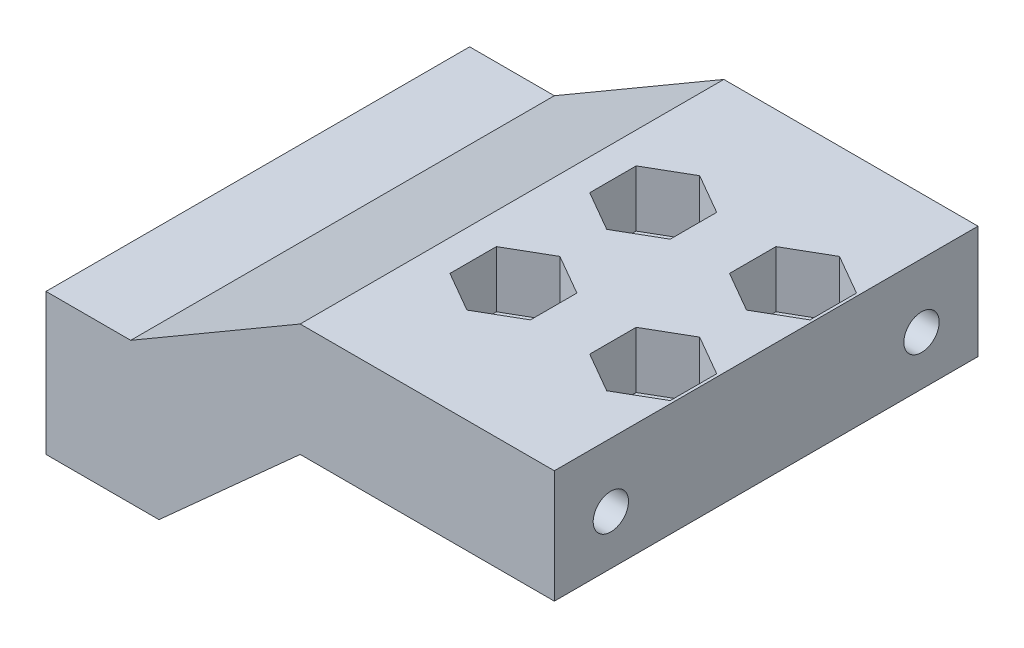
from build123d import *

# Parameters (mm, degrees)
SKETCH_1_W          = 41
SKETCH_1_H          = 30
EXTRUDE_1_DEPTH     = 10
SKETCH_3_W          = 30
SKETCH_3_H          = 10
CUT_EXTRUDE_2_DEPTH = 3
SKETCH_4_R          = 1.25
SKETCH_4_W          = 0.256410257
SKETCH_4_H          = 0.256410257
CUT_EXTRUDE_3_DEPTH = 5
EXTRUDE_3_DEPTH     = 30
SKETCH_6_W          = 20
SKETCH_6_H          = 30
CUT_EXTRUDE_5_DEPTH = 9
SKETCH_2_R          = 1.25
CUT_EXTRUDE_1_DEPTH = 4.5
SKETCH_8_R          = 1.5
CUT_EXTRUDE_6_DEPTH = 52.594573358
CUT_EXTRUDE_7_DEPTH = 54.572380944
CUT_EXTRUDE_8_DEPTH = 4
SKETCH_11_W         = 4.132049734
SKETCH_11_H         = 3.255839909
CUT_EXTRUDE_9_DEPTH = 54.572380944


with BuildPart() as part:
    # Эскиз1 → Бобышка-Вытянуть1 (new body)
    with BuildSketch(Plane(origin=(0, 0, 0), x_dir=(1, 0, 0), z_dir=(0, 1, 0))):
        with Locations((20.5, 15)):
            Rectangle(SKETCH_1_W, SKETCH_1_H)
    extrude(amount=EXTRUDE_1_DEPTH)

    # Эскиз3 → Вырез-Вытянуть2 (cut)
    with BuildSketch(Plane.ZY):
        with Locations((-15, 5)):
            Rectangle(SKETCH_3_W, SKETCH_3_H)
    extrude(amount=-CUT_EXTRUDE_2_DEPTH, mode=Mode.SUBTRACT)

    # Эскиз4 → Вырез-Вытянуть3 (cut)
    # profile 1 of 28: a face of its own
    with BuildSketch(Plane.ZY.offset(-3)):
        with Locations((-20, 5.4)):
            Circle(SKETCH_4_R)
    # profile 2 of 28: a face of its own
    with BuildSketch(Plane.ZY.offset(-3)):
        with Locations((-10, 5.4)):
            Circle(SKETCH_4_R)
    # profile 3 of 28: a face of its own
    with BuildSketch(Plane.ZY.offset(-3)):
        with BuildLine():
            add(Edge.make_bspline(
                [(-35.363946403, 20.739364989), (-35.363228406, 20.771842074), (-35.361839029, 20.834687605), (-35.351889854, 20.92588131), (-35.334832719, 21.010545005), (-35.310895369, 21.088758207), (-35.279939632, 21.16054556), (-35.241697731, 21.225504292), (-35.197224371, 21.284827807), (-35.161732095, 21.3183601), (-35.14399448, 21.335118194)],
                knots=[0, 0, 0, 0, 1.189940866, 2.302622481, 3.356378305, 4.350088409, 5.294652018, 6.213657312, 7.107257627, 8, 8, 8, 8], degree=3))
            add(Edge.make_bspline(
                [(-35.14399448, 21.335118194), (-35.128480596, 21.347996943), (-35.097735901, 21.37351945), (-35.047554847, 21.405885971), (-34.995310785, 21.433694364), (-34.940542068, 21.45675177), (-34.883075605, 21.474368462), (-34.823090341, 21.486595232), (-34.760662948, 21.494583265), (-34.718138321, 21.495372997), (-34.696478454, 21.495775245)],
                knots=[0, 0, 0, 0, 0.994414631, 1.970684744, 2.940793954, 3.912782355, 4.898970837, 5.902128985, 6.931451948, 8, 8, 8, 8], degree=3))
            add(Edge.make_bspline(
                [(-34.696478454, 21.495775245), (-34.67255192, 21.495100196), (-34.625735221, 21.493779336), (-34.557034233, 21.485165892), (-34.491979109, 21.469159052), (-34.429732188, 21.448180458), (-34.371236037, 21.420222955), (-34.31556673, 21.386891879), (-34.264087397, 21.3464973), (-34.215811401, 21.300838878), (-34.172260849, 21.249777726), (-34.134317829, 21.193564732), (-34.102185517, 21.132685488), (-34.075642457, 21.067082279), (-34.05528669, 20.996709245), (-34.041098201, 20.921716774), (-34.032008952, 20.842286513), (-34.031085823, 20.787734766), (-34.03061307, 20.759797681)],
                knots=[0, 0, 0, 0, 1.026363227, 2.008269884, 2.962742747, 3.895658536, 4.820662428, 5.738204837, 6.673158329, 7.621267452, 8.584296177, 9.545483285, 10.524327568, 11.531652541, 12.575780624, 13.660990097, 14.802144351, 16, 16, 16, 16], degree=3))
            add(Edge.make_bspline(
                [(-34.03061307, 20.759797681), (-34.030791195, 20.737087805), (-34.031137268, 20.692965556), (-34.035320501, 20.628675629), (-34.041642001, 20.568114813), (-34.050245708, 20.511214185), (-34.061835316, 20.458064978), (-34.076287713, 20.408709865), (-34.093048185, 20.362882295), (-34.112311307, 20.320533354), (-34.134291323, 20.281320943), (-34.158236895, 20.244399903), (-34.184749965, 20.209826246), (-34.213796545, 20.17765727), (-34.244984674, 20.147659672), (-34.278527148, 20.119719733), (-34.314485883, 20.094239695), (-34.365252448, 20.063303526), (-34.432257996, 20.030885775), (-34.517123878, 20.003104446), (-34.605661514, 19.986171896), (-34.665955622, 19.984035995), (-34.696478454, 19.982954733)],
                knots=[0, 0, 0, 0, 1.174068422, 2.28105775, 3.329581501, 4.321819531, 5.255045276, 6.14001734, 6.978936381, 7.776151739, 8.542754425, 9.301196708, 10.049767304, 10.792968067, 11.540167917, 12.285482871, 13.048063169, 13.816653646, 15.357768987, 16.884132754, 18.422646949, 20, 20, 20, 20], degree=3))
            add(Edge.make_bspline(
                [(-34.696478454, 19.982954733), (-34.720809684, 19.983614629), (-34.768432719, 19.984906231), (-34.838105368, 19.993718653), (-34.904228964, 20.008818808), (-34.966604046, 20.030823915), (-35.025786539, 20.057836226), (-35.081217179, 20.09155691), (-35.133003072, 20.131251223), (-35.180686873, 20.177175247), (-35.224285817, 20.228305709), (-35.261503049, 20.285740473), (-35.29335645, 20.348294913), (-35.319380621, 20.416238813), (-35.339259458, 20.489574216), (-35.353534909, 20.568108062), (-35.362558377, 20.651948316), (-35.363475274, 20.709693722), (-35.363946403, 20.739364989)],
                knots=[0, 0, 0, 0, 1.022681766, 2.001674804, 2.94671416, 3.868132449, 4.777362857, 5.676573364, 6.589418535, 7.514523194, 8.454681358, 9.407574523, 10.384198733, 11.400667853, 12.460217505, 13.573389442, 14.753137007, 16, 16, 16, 16], degree=3))
        make_face()
        with BuildLine():
            add(Edge.make_bspline(
                [(-35.107536147, 20.740166271), (-35.107101, 20.718789781), (-35.106259283, 20.67744056), (-35.101235863, 20.617423663), (-35.092058998, 20.56170522), (-35.07929187, 20.510082802), (-35.062916522, 20.46254909), (-35.042846703, 20.419023607), (-35.019301373, 20.379469455), (-34.991769618, 20.344531458), (-34.961805685, 20.313650147), (-34.929487091, 20.287012569), (-34.895263287, 20.264393947), (-34.859076111, 20.245951376), (-34.821089434, 20.231380087), (-34.781220608, 20.220888495), (-34.739398931, 20.214864195), (-34.71092062, 20.214107636), (-34.696478454, 20.213723963)],
                knots=[0, 0, 0, 0, 1.36128903, 2.633184439, 3.831299874, 4.953299848, 6.015607462, 7.027679361, 8.000438392, 8.93945591, 9.853536715, 10.73548639, 11.60109037, 12.460616037, 13.316600729, 14.187036799, 15.080594522, 16, 16, 16, 16], degree=3))
            add(Edge.make_bspline(
                [(-34.696478454, 20.213723963), (-34.682160394, 20.214051164), (-34.65390943, 20.214696763), (-34.612632178, 20.221531761), (-34.572906423, 20.231337251), (-34.535060383, 20.245805824), (-34.499408947, 20.264891183), (-34.465261257, 20.287466632), (-34.433309474, 20.314493936), (-34.403002734, 20.345316077), (-34.375864372, 20.380769593), (-34.351522011, 20.420167095), (-34.331521848, 20.4643995), (-34.31535306, 20.512789469), (-34.302444541, 20.565440029), (-34.293310412, 20.622371286), (-34.288316326, 20.683719989), (-34.287462884, 20.726001633), (-34.287023326, 20.747778451)],
                knots=[0, 0, 0, 0, 0.904535546, 1.784739026, 2.638791991, 3.488785886, 4.338695884, 5.191202824, 6.07237792, 6.980061329, 7.919174549, 8.889507933, 9.902165842, 10.981000531, 12.111539881, 13.326270405, 14.622917219, 16, 16, 16, 16], degree=3))
            add(Edge.make_bspline(
                [(-34.287023326, 20.747778451), (-34.287466589, 20.768352988), (-34.288328664, 20.808367114), (-34.293295856, 20.866530413), (-34.302590671, 20.920748758), (-34.315109494, 20.971174972), (-34.332269698, 21.017393823), (-34.351987373, 21.060281529), (-34.376329782, 21.098987477), (-34.403945965, 21.133729989), (-34.434087869, 21.164648564), (-34.466120197, 21.191782788), (-34.500376626, 21.214066323), (-34.536031875, 21.233011037), (-34.573663406, 21.247166295), (-34.612915591, 21.257873801), (-34.654090864, 21.263878118), (-34.682170279, 21.264625287), (-34.696478454, 21.265006015)],
                knots=[0, 0, 0, 0, 1.329905342, 2.586449315, 3.768451236, 4.882143757, 5.938857988, 6.950440627, 7.927559667, 8.885972819, 9.813736587, 10.714405609, 11.592966897, 12.450023853, 13.318821862, 14.185602452, 15.075453733, 16, 16, 16, 16], degree=3))
            add(Edge.make_bspline(
                [(-34.696478454, 21.265006015), (-34.710919393, 21.264619156), (-34.739395285, 21.263856316), (-34.781234565, 21.25787772), (-34.820993272, 21.247230948), (-34.859173518, 21.233294947), (-34.895227082, 21.214675106), (-34.929649087, 21.192180659), (-34.961523309, 21.165038439), (-34.991940522, 21.134634705), (-35.019156415, 21.09969276), (-35.042862001, 21.060536118), (-35.062996361, 21.017282632), (-35.079280154, 20.969844887), (-35.092062391, 20.91822792), (-35.10123509, 20.86250788), (-35.106247452, 20.802624573), (-35.107097845, 20.761409131), (-35.107536147, 20.740166271)],
                knots=[0, 0, 0, 0, 0.920966903, 1.816042154, 2.687956485, 3.542385364, 4.403370762, 5.270444796, 6.159337503, 7.068888003, 8.009500254, 8.976623456, 9.982690403, 11.046802133, 12.170707598, 13.370857791, 14.644913259, 16, 16, 16, 16], degree=3))
        make_face(mode=Mode.SUBTRACT)
    # profile 4 of 28: a face of its own
    with BuildSketch(Plane.ZY.offset(-3)):
        Polygon((-33.876766916, 21.47013422), (-32.697279736, 21.47013422), (-32.697279736, 21.239364989), (-33.158818198, 21.239364989), (-33.158818198, 20.008595758), (-33.415228454, 20.008595758), (-33.415228454, 21.239364989), (-33.876766916, 21.239364989), align=None)
    # profile 5 of 28: a face of its own
    with BuildSketch(Plane.ZY.offset(-3)):
        with BuildLine():
            Line((-32.492151531, 21.47013422), (-31.924042557, 21.47013422))
            add(Edge.make_bspline(
                [(-31.924042557, 21.47013422), (-31.907081369, 21.470087382), (-31.874352405, 21.469997003), (-31.827048252, 21.468466067), (-31.783126183, 21.465445772), (-31.742418538, 21.462339604), (-31.705250325, 21.456672053), (-31.671265191, 21.451579721), (-31.64087142, 21.444115107), (-31.604571076, 21.433776722), (-31.562802313, 21.416026719), (-31.516784209, 21.387619112), (-31.474137967, 21.352308349), (-31.436146339, 21.310175404), (-31.403664362, 21.26245004), (-31.380759104, 21.208868207), (-31.366079419, 21.150939212), (-31.36466859, 21.110583507), (-31.363946403, 21.089925886)],
                knots=[0, 0, 0, 0, 1.058298069, 2.042132929, 2.952278881, 3.805526406, 4.588011129, 5.297621114, 5.948433391, 6.539063572, 7.651827464, 8.766555196, 9.902813926, 11.094491351, 12.296264475, 13.486717663, 14.713479775, 16, 16, 16, 16], degree=3))
            add(Edge.make_bspline(
                [(-31.363946403, 21.089925886), (-31.364410477, 21.073321386), (-31.365312049, 21.041063217), (-31.37449238, 20.994287327), (-31.38912353, 20.950702332), (-31.410394609, 20.910632577), (-31.437053284, 20.873628698), (-31.470113032, 20.840399892), (-31.508360222, 20.809312093), (-31.537556614, 20.792517384), (-31.552648326, 20.783836143)],
                knots=[0, 0, 0, 0, 1.048641836, 2.037234724, 3.001145402, 3.945328978, 4.894482768, 5.873692534, 6.900904625, 8, 8, 8, 8], degree=3))
            add(Edge.make_bspline(
                [(-31.552648326, 20.783836143), (-31.535805906, 20.77733845), (-31.502334042, 20.764425228), (-31.45677091, 20.734493467), (-31.415757258, 20.697422008), (-31.379719638, 20.653122762), (-31.349624382, 20.60317768), (-31.328238585, 20.547603177), (-31.315103906, 20.487706279), (-31.313491304, 20.446164599), (-31.312664352, 20.424861784)],
                knots=[0, 0, 0, 0, 0.937381678, 1.862909929, 2.817732642, 3.805683842, 4.824953597, 5.839566958, 6.892117343, 8, 8, 8, 8], degree=3))
            add(Edge.make_bspline(
                [(-31.312664352, 20.424861784), (-31.314054161, 20.407721269), (-31.316753235, 20.374433586), (-31.32642283, 20.326560818), (-31.338422564, 20.281831563), (-31.354999274, 20.24056053), (-31.375502039, 20.202924226), (-31.399292065, 20.168311203), (-31.427053941, 20.137375343), (-31.458656089, 20.109961614), (-31.493832306, 20.085731226), (-31.532786711, 20.064864912), (-31.575666571, 20.047848055), (-31.621945965, 20.033266034), (-31.672229134, 20.022185258), (-31.726322787, 20.014322283), (-31.784129511, 20.009446367), (-31.823872361, 20.008884676), (-31.844314993, 20.008595758)],
                knots=[0, 0, 0, 0, 1.080548592, 2.09847608, 3.06639211, 3.989663273, 4.887840429, 5.756840003, 6.62518998, 7.49427072, 8.381862128, 9.306202247, 10.266913345, 11.27896856, 12.354806861, 13.500990184, 14.714577954, 16, 16, 16, 16], degree=3))
            Line((-31.844314993, 20.008595758), (-32.492151531, 20.008595758))
            Line((-32.492151531, 20.008595758), (-32.492151531, 21.47013422))
        make_face()
        with BuildLine():
            Line((-32.235741275, 20.88039063), (-31.979331018, 20.88039063))
            add(Edge.make_bspline(
                [(-31.979331018, 20.88039063), (-31.967045182, 20.880543574), (-31.943408185, 20.880837826), (-31.909473504, 20.880951017), (-31.878624841, 20.882284669), (-31.850835705, 20.883811701), (-31.825998106, 20.885867127), (-31.804018668, 20.887971316), (-31.7852493, 20.891398763), (-31.764086522, 20.895397539), (-31.740355188, 20.903465041), (-31.713655056, 20.916314338), (-31.688656654, 20.932973529), (-31.665534257, 20.952784099), (-31.645512671, 20.975524831), (-31.63068448, 21.001166467), (-31.621863775, 21.029263705), (-31.620866256, 21.048730827), (-31.620356659, 21.058675886)],
                knots=[0, 0, 0, 0, 1.313454734, 2.526984988, 3.627058545, 4.61374519, 5.501720711, 6.291550108, 6.972164843, 7.540515364, 8.592384107, 9.639495215, 10.700623205, 11.793820655, 12.887018104, 13.922877517, 14.93887201, 16, 16, 16, 16], degree=3))
            add(Edge.make_bspline(
                [(-31.620356659, 21.058675886), (-31.620584652, 21.066831243), (-31.62102438, 21.082560405), (-31.62446459, 21.105281187), (-31.631222359, 21.12582171), (-31.63921614, 21.144959685), (-31.650957053, 21.161549641), (-31.664558681, 21.17669676), (-31.681179791, 21.189328647), (-31.700084618, 21.200496034), (-31.722129368, 21.209606836), (-31.747361623, 21.217489083), (-31.776015644, 21.22427174), (-31.808262597, 21.229833601), (-31.844108712, 21.234069836), (-31.883388592, 21.23738123), (-31.926170809, 21.238720424), (-31.955826563, 21.239143816), (-31.971318198, 21.239364989)],
                knots=[0, 0, 0, 0, 0.873986897, 1.685650434, 2.450552134, 3.187222912, 3.897714545, 4.616801147, 5.361077362, 6.124370998, 6.964304915, 7.910196863, 8.954951026, 10.117177675, 11.414693997, 12.821774116, 14.339751732, 16, 16, 16, 16], degree=3))
            Line((-31.971318198, 21.239364989), (-32.235741275, 21.239364989))
            Line((-32.235741275, 21.239364989), (-32.235741275, 20.88039063))
        make_face(mode=Mode.SUBTRACT)
        with BuildLine():
            Line((-32.235741275, 20.239364989), (-31.924042557, 20.239364989))
            add(Edge.make_bspline(
                [(-31.924042557, 20.239364989), (-31.907881499, 20.239541415), (-31.877015408, 20.239878371), (-31.832637351, 20.241790654), (-31.792247628, 20.245275618), (-31.755750313, 20.250471356), (-31.723120396, 20.25688699), (-31.694305323, 20.264139654), (-31.669449548, 20.273424644), (-31.648279315, 20.28426209), (-31.630204507, 20.296932479), (-31.614630102, 20.311612632), (-31.601603151, 20.328554283), (-31.590014592, 20.347165116), (-31.581303893, 20.36816909), (-31.575043807, 20.391218106), (-31.57044812, 20.416145936), (-31.569542231, 20.433520941), (-31.569074608, 20.442489989)],
                knots=[0, 0, 0, 0, 1.662712069, 3.175622561, 4.568815167, 5.831807504, 6.966214793, 7.989326693, 8.885035463, 9.690060269, 10.429574624, 11.148771252, 11.882648201, 12.622545361, 13.398312747, 14.211735605, 15.076890674, 16, 16, 16, 16], degree=3))
            add(Edge.make_bspline(
                [(-31.569074608, 20.442489989), (-31.56965205, 20.453219831), (-31.570808499, 20.474708592), (-31.579028278, 20.506243129), (-31.592965659, 20.536420725), (-31.612267421, 20.564357747), (-31.634825406, 20.590057368), (-31.662065119, 20.61046959), (-31.692400456, 20.625911405), (-31.727464771, 20.636097071), (-31.769114907, 20.641948331), (-31.81977533, 20.646753011), (-31.881015572, 20.649317399), (-31.925376363, 20.649514941), (-31.949282941, 20.649621399)],
                knots=[0, 0, 0, 0, 0.7848001, 1.571726951, 2.367584096, 3.205130275, 4.04920768, 4.858393503, 5.680052948, 6.527179817, 7.516875936, 8.753803071, 10.250584383, 12, 12, 12, 12], degree=3))
            Line((-31.949282941, 20.649621399), (-32.235741275, 20.649621399))
            Line((-32.235741275, 20.649621399), (-32.235741275, 20.239364989))
        make_face(mode=Mode.SUBTRACT)
    # profile 6 of 28: a face of its own
    with BuildSketch(Plane.ZY.offset(-3)):
        with BuildLine():
            Line((-30.033417557, 20.444493194), (-29.782215634, 20.418852169))
            add(Edge.make_bspline(
                [(-29.782215634, 20.418852169), (-29.787366269, 20.401907957), (-29.797498575, 20.368575379), (-29.818057079, 20.321299704), (-29.840648098, 20.276385568), (-29.867338926, 20.234811703), (-29.896625252, 20.19569329), (-29.929087338, 20.159342353), (-29.965434766, 20.126676082), (-30.004316492, 20.096330302), (-30.046379463, 20.069661475), (-30.091180277, 20.04611608), (-30.13888298, 20.026684099), (-30.189351425, 20.010496172), (-30.242700976, 19.998149715), (-30.298832653, 19.98962022), (-30.357672398, 19.983577397), (-30.39785108, 19.983165657), (-30.418433582, 19.982954733)],
                knots=[0, 0, 0, 0, 1.017198368, 2.001028156, 2.958938375, 3.904526299, 4.836491671, 5.766019286, 6.700699831, 7.641977538, 8.598163567, 9.559604839, 10.547559217, 11.555094156, 12.60347703, 13.691418688, 14.817373327, 16, 16, 16, 16], degree=3))
            add(Edge.make_bspline(
                [(-30.418433582, 19.982954733), (-30.44423795, 19.983561124), (-30.494548464, 19.984743398), (-30.568020842, 19.994227905), (-30.637421553, 20.009231339), (-30.702901736, 20.030488571), (-30.764041769, 20.058190636), (-30.820996911, 20.092261204), (-30.87412143, 20.131913131), (-30.922650602, 20.177844718), (-30.966557857, 20.229036167), (-31.004056448, 20.285956573), (-31.036578335, 20.347241801), (-31.062444184, 20.413887359), (-31.08288871, 20.485225969), (-31.097073975, 20.561561232), (-31.106149706, 20.642590287), (-31.107066007, 20.698340557), (-31.107536147, 20.726945117)],
                knots=[0, 0, 0, 0, 1.077616366, 2.10101772, 3.089143248, 4.040031729, 4.971276009, 5.886882173, 6.807369977, 7.734796568, 8.672701003, 9.618074947, 10.576315496, 11.565652878, 12.598619221, 13.67195277, 14.805516698, 16, 16, 16, 16], degree=3))
            add(Edge.make_bspline(
                [(-31.107536147, 20.726945117), (-31.107061451, 20.756615191), (-31.106139737, 20.814225429), (-31.097180369, 20.898105825), (-31.082363426, 20.976861341), (-31.062257261, 21.050777707), (-31.035615263, 21.11949785), (-31.003107195, 21.182996716), (-30.964934064, 21.241618109), (-30.92072713, 21.294503621), (-30.871811857, 21.341531743), (-30.819742404, 21.383350112), (-30.763425975, 21.417861424), (-30.704013716, 21.446515093), (-30.640933008, 21.468529721), (-30.574572435, 21.484742411), (-30.504426713, 21.493890788), (-30.456520235, 21.495138212), (-30.432055377, 21.495775245)],
                knots=[0, 0, 0, 0, 1.232307979, 2.392766439, 3.499416159, 4.558769794, 5.570548426, 6.555643267, 7.517416609, 8.470735273, 9.412423306, 10.33263532, 11.239503873, 12.150233765, 13.067967044, 14.009932887, 14.983713455, 16, 16, 16, 16], degree=3))
            add(Edge.make_bspline(
                [(-30.432055377, 21.495775245), (-30.408384698, 21.49516655), (-30.362060487, 21.493975316), (-30.294193954, 21.484414352), (-30.229525354, 21.469473732), (-30.168190458, 21.447773299), (-30.11049796, 21.419287865), (-30.055824778, 21.385289843), (-30.00455284, 21.344795272), (-29.957010977, 21.298355919), (-29.913693263, 21.246493192), (-29.87622279, 21.189005957), (-29.844494621, 21.126702572), (-29.818774191, 21.059106722), (-29.79897555, 20.986608017), (-29.78463196, 20.909158991), (-29.775586214, 20.826785978), (-29.774672514, 20.770105171), (-29.774202813, 20.740967553)],
                knots=[0, 0, 0, 0, 1.005323219, 1.967446859, 2.906060863, 3.821317632, 4.724696067, 5.63467896, 6.55185077, 7.494776645, 8.453732942, 9.416859909, 10.403972786, 11.418730779, 12.484189468, 13.592581733, 14.76243057, 16, 16, 16, 16], degree=3))
            add(Edge.make_bspline(
                [(-29.774202813, 20.740967553), (-29.774324829, 20.731886152), (-29.774619122, 20.709982553), (-29.775114655, 20.688082529), (-29.775404736, 20.675262425)],
                knots=[0, 0, 0, 0, 0.829215456, 2, 2, 2, 2], degree=3))
            Line((-29.775404736, 20.675262425), (-30.85112589, 20.675262425))
            add(Edge.make_bspline(
                [(-30.85112589, 20.675262425), (-30.84964147, 20.657204533), (-30.846737352, 20.621876078), (-30.838268519, 20.570726992), (-30.826839625, 20.522657338), (-30.811454985, 20.478090374), (-30.793280603, 20.436526964), (-30.770820126, 20.398650762), (-30.745797245, 20.363620531), (-30.717046577, 20.332290329), (-30.68601903, 20.304422372), (-30.652815833, 20.279975896), (-30.617495869, 20.259699477), (-30.580570097, 20.242653535), (-30.541693455, 20.229826442), (-30.501043361, 20.220646994), (-30.458392946, 20.214904047), (-30.429269081, 20.214122334), (-30.414427172, 20.213723963)],
                knots=[0, 0, 0, 0, 1.224729154, 2.396059788, 3.502114335, 4.561587772, 5.580251543, 6.563724943, 7.533714888, 8.486186356, 9.43260269, 10.350144711, 11.268619442, 12.181885516, 13.095687177, 14.031096784, 14.996620783, 16, 16, 16, 16], degree=3))
            add(Edge.make_bspline(
                [(-30.414427172, 20.213723963), (-30.392756932, 20.214449518), (-30.350776203, 20.215855102), (-30.290201814, 20.22571628), (-30.234675864, 20.243103515), (-30.183808143, 20.267239275), (-30.137683061, 20.299233183), (-30.097435055, 20.340184795), (-30.061651596, 20.388719804), (-30.043040119, 20.425484828), (-30.033417557, 20.444493194)],
                knots=[0, 0, 0, 0, 1.096312125, 2.123833578, 3.094060441, 4.030938787, 4.962563683, 5.918139224, 6.923629937, 8, 8, 8, 8], degree=3))
        make_face()
        with BuildLine():
            Line((-30.85112589, 20.906031656), (-30.03061307, 20.906031656))
            add(Edge.make_bspline(
                [(-30.03061307, 20.906031656), (-30.032227106, 20.918735905), (-30.0353829, 20.94357549), (-30.042025339, 20.979502847), (-30.05088424, 21.012976088), (-30.061553428, 21.043869487), (-30.07456378, 21.072242186), (-30.089263358, 21.098137721), (-30.10568829, 21.121832638), (-30.118453769, 21.135603139), (-30.124763711, 21.142409861)],
                knots=[0, 0, 0, 0, 1.185316253, 2.317552585, 3.379013743, 4.387694847, 5.339152611, 6.263729899, 7.141766409, 8, 8, 8, 8], degree=3))
            add(Edge.make_bspline(
                [(-30.124763711, 21.142409861), (-30.134845559, 21.152250066), (-30.154758932, 21.171686152), (-30.187959916, 21.19674051), (-30.223641168, 21.217517789), (-30.261109002, 21.23544476), (-30.301201473, 21.248432381), (-30.343115871, 21.258243775), (-30.387435655, 21.26380176), (-30.417751023, 21.264598489), (-30.4332573, 21.265006015)],
                knots=[0, 0, 0, 0, 0.989486767, 1.954405495, 2.91383024, 3.888017634, 4.867526279, 5.869356945, 6.910178459, 8, 8, 8, 8], degree=3))
            add(Edge.make_bspline(
                [(-30.4332573, 21.265006015), (-30.4472916, 21.264680108), (-30.474762775, 21.264042169), (-30.515233861, 21.259552998), (-30.554022817, 21.252111103), (-30.591060884, 21.241069469), (-30.626483352, 21.227649672), (-30.660041153, 21.210495028), (-30.691969186, 21.190561929), (-30.722140282, 21.167761173), (-30.749434013, 21.142208726), (-30.774394487, 21.114989684), (-30.795059258, 21.084906402), (-30.813381698, 21.053360561), (-30.827728292, 21.01936766), (-30.839022564, 20.983428455), (-30.847062323, 20.945443901), (-30.849759298, 20.919286129), (-30.85112589, 20.906031656)],
                knots=[0, 0, 0, 0, 1.10270868, 2.158476208, 3.195774995, 4.201977093, 5.192014471, 6.168217026, 7.158254405, 8.146844603, 9.134487423, 10.093158795, 11.042305272, 11.996428104, 12.955501471, 13.934632866, 14.95345241, 16, 16, 16, 16], degree=3))
        make_face(mode=Mode.SUBTRACT)
    # profile 7 of 28: a face of its own
    with BuildSketch(Plane.ZY.offset(-3)):
        with BuildLine():
            Line((-29.492151531, 19.47013422), (-29.492151531, 21.47013422))
            Line((-29.492151531, 21.47013422), (-29.235741275, 21.47013422))
            Line((-29.235741275, 21.47013422), (-29.235741275, 21.238163066))
            add(Edge.make_bspline(
                [(-29.235741275, 21.238163066), (-29.222880996, 21.258571943), (-29.198107507, 21.297886728), (-29.156381184, 21.350939975), (-29.111605422, 21.395333689), (-29.064239169, 21.432405693), (-29.012412053, 21.460820759), (-28.956059994, 21.481544974), (-28.89437382, 21.493644559), (-28.851580728, 21.495049847), (-28.829491275, 21.495775245)],
                knots=[0, 0, 0, 0, 1.141868254, 2.199646056, 3.187916027, 4.121412168, 5.038483649, 5.974824485, 6.95462054, 8, 8, 8, 8], degree=3))
            add(Edge.make_bspline(
                [(-28.829491275, 21.495775245), (-28.814789522, 21.495447876), (-28.785721096, 21.494800598), (-28.74275721, 21.490237514), (-28.70093118, 21.483163811), (-28.660438367, 21.47277057), (-28.621495458, 21.459080448), (-28.583967946, 21.442397495), (-28.547447579, 21.423385974), (-28.512585121, 21.400805941), (-28.479569353, 21.375545899), (-28.447924714, 21.348427284), (-28.419201349, 21.317951536), (-28.391827342, 21.285704052), (-28.366936282, 21.250702191), (-28.344491096, 21.213038554), (-28.32366313, 21.173268355), (-28.299138632, 21.116572419), (-28.273093555, 21.042202441), (-28.251926336, 20.948349774), (-28.23812318, 20.850618505), (-28.236543702, 20.784017707), (-28.235741275, 20.750182297)],
                knots=[0, 0, 0, 0, 0.824202902, 1.629620634, 2.419929953, 3.200854495, 3.970497378, 4.731532444, 5.501903467, 6.276628953, 7.056871135, 7.831705169, 8.610184821, 9.402088757, 10.202023236, 11.014889876, 11.858855485, 12.71721399, 14.476656902, 16.267557585, 18.103795699, 20, 20, 20, 20], degree=3))
            add(Edge.make_bspline(
                [(-28.235741275, 20.750182297), (-28.236589661, 20.714071453), (-28.23825, 20.643400536), (-28.253471944, 20.54012206), (-28.278223954, 20.442343758), (-28.307075658, 20.365206289), (-28.334732342, 20.307182802), (-28.358180391, 20.266649512), (-28.383323704, 20.228544059), (-28.410698023, 20.192862652), (-28.440867916, 20.160185697), (-28.472847625, 20.12963587), (-28.507054161, 20.101764148), (-28.555319377, 20.069172797), (-28.618158709, 20.035039996), (-28.696692584, 20.004791889), (-28.777507776, 19.98653815), (-28.832205831, 19.984148754), (-28.859539352, 19.982954733)],
                knots=[0, 0, 0, 0, 1.566750505, 3.066217315, 4.520030908, 5.938083948, 6.632957415, 7.30813415, 7.968947793, 8.613647255, 9.257851326, 9.897527079, 10.532192309, 11.170526994, 12.423402314, 13.627070148, 14.814207778, 16, 16, 16, 16], degree=3))
            add(Edge.make_bspline(
                [(-28.859539352, 19.982954733), (-28.879367874, 19.983559251), (-28.918158177, 19.984741862), (-28.974684389, 19.996684883), (-29.028341908, 20.014716883), (-29.077984186, 20.041349511), (-29.123887183, 20.072901582), (-29.165649875, 20.108749971), (-29.203509337, 20.148175065), (-29.224968144, 20.177411536), (-29.235741275, 20.192089348)],
                knots=[0, 0, 0, 0, 1.060500719, 2.074645059, 3.081194601, 4.082546779, 5.08044464, 6.05947861, 7.025785017, 8, 8, 8, 8], degree=3))
            Line((-29.235741275, 20.192089348), (-29.235741275, 19.47013422))
            Line((-29.235741275, 19.47013422), (-29.492151531, 19.47013422))
        make_face()
        with BuildLine():
            add(Edge.make_bspline(
                [(-29.235741275, 20.727345758), (-29.235494043, 20.706099519), (-29.235015872, 20.665007039), (-29.22965101, 20.605599749), (-29.221388818, 20.550568645), (-29.20991485, 20.499704171), (-29.194722438, 20.453171312), (-29.176340176, 20.410826616), (-29.154613218, 20.372670563), (-29.129393259, 20.339037685), (-29.10144268, 20.309930037), (-29.072680634, 20.283907713), (-29.042087668, 20.262258602), (-29.010193372, 20.244359472), (-28.976692708, 20.230601039), (-28.941665464, 20.22118569), (-28.905442364, 20.214812511), (-28.880800751, 20.214089288), (-28.868353454, 20.213723963)],
                knots=[0, 0, 0, 0, 1.437434546, 2.78015081, 4.032764778, 5.2012756, 6.304456418, 7.34047555, 8.320212436, 9.269161424, 10.176980179, 11.047598006, 11.89018243, 12.707424221, 13.518042872, 14.333683991, 15.158288469, 16, 16, 16, 16], degree=3))
            add(Edge.make_bspline(
                [(-28.868353454, 20.213723963), (-28.8556463, 20.214113637), (-28.830488013, 20.214885132), (-28.793425901, 20.220895388), (-28.758086044, 20.231576945), (-28.723883446, 20.245532289), (-28.691545641, 20.264351589), (-28.659895658, 20.286271377), (-28.630350318, 20.313178973), (-28.601718516, 20.343468183), (-28.575588039, 20.378352034), (-28.553105784, 20.417961481), (-28.534402706, 20.462007948), (-28.51870855, 20.510238161), (-28.506896244, 20.563120414), (-28.49816539, 20.620266632), (-28.49289525, 20.681974326), (-28.492405331, 20.724530557), (-28.492151531, 20.746576528)],
                knots=[0, 0, 0, 0, 0.83316913, 1.649551805, 2.453198062, 3.250183293, 4.066002037, 4.901882611, 5.770302609, 6.681184977, 7.632314019, 8.620852534, 9.660448002, 10.765528849, 11.942537832, 13.209677882, 14.554492318, 16, 16, 16, 16], degree=3))
            add(Edge.make_bspline(
                [(-28.492151531, 20.746576528), (-28.492403781, 20.767555305), (-28.492893058, 20.808246897), (-28.498223066, 20.867125646), (-28.50659953, 20.922000367), (-28.517927557, 20.972889977), (-28.533164049, 21.019745105), (-28.552054609, 21.062384738), (-28.574074739, 21.101155662), (-28.599433986, 21.135647758), (-28.626965375, 21.165988313), (-28.656160768, 21.192332093), (-28.686374851, 21.214825334), (-28.718180178, 21.233048582), (-28.751068817, 21.247805257), (-28.785649093, 21.25755745), (-28.821376581, 21.263930825), (-28.845622344, 21.264643863), (-28.857936788, 21.265006015)],
                knots=[0, 0, 0, 0, 1.417753527, 2.749952742, 3.99222208, 5.168205227, 6.27013346, 7.316877701, 8.315654914, 9.278031164, 10.204687429, 11.080340169, 11.932552405, 12.745464952, 13.553904146, 14.362393741, 15.168258362, 16, 16, 16, 16], degree=3))
            add(Edge.make_bspline(
                [(-28.857936788, 21.265006015), (-28.870252103, 21.264659899), (-28.894654299, 21.263974087), (-28.93059483, 21.257291108), (-28.965342891, 21.246477883), (-28.998792704, 21.230912163), (-29.031478641, 21.211560644), (-29.063192721, 21.187949005), (-29.093292531, 21.159386371), (-29.122472838, 21.127260049), (-29.149304014, 21.090903028), (-29.172690587, 21.050473807), (-29.192312908, 21.006121479), (-29.208284132, 20.957801224), (-29.220622835, 20.905638069), (-29.229185752, 20.84962845), (-29.235126536, 20.7898395), (-29.235532247, 20.748595363), (-29.235741275, 20.727345758)],
                knots=[0, 0, 0, 0, 0.806892931, 1.598819005, 2.388223016, 3.187667544, 4.012236564, 4.875742748, 5.774202643, 6.729148108, 7.718801443, 8.731210163, 9.785807378, 10.893572366, 12.063989118, 13.296455458, 14.607092894, 16, 16, 16, 16], degree=3))
        make_face(mode=Mode.SUBTRACT)
    # profile 8 of 28: a face of its own
    with BuildSketch(Plane.ZY.offset(-3)):
        with BuildLine():
            Line((-27.03061307, 20.547057297), (-26.774202813, 20.521416271))
            add(Edge.make_bspline(
                [(-26.774202813, 20.521416271), (-26.777751314, 20.500915162), (-26.784721373, 20.46064635), (-26.80054714, 20.402391121), (-26.820009625, 20.347554794), (-26.843513059, 20.296102616), (-26.870544416, 20.248120449), (-26.901711732, 20.203602006), (-26.936744166, 20.162575101), (-26.975329009, 20.125076168), (-27.017267799, 20.091852271), (-27.061251121, 20.062306121), (-27.108004124, 20.037964132), (-27.156765133, 20.017714955), (-27.207898065, 20.002124284), (-27.261364542, 19.990807086), (-27.317188133, 19.984513584), (-27.355117493, 19.983479455), (-27.37436307, 19.982954733)],
                knots=[0, 0, 0, 0, 1.126290047, 2.212288299, 3.264625211, 4.274421374, 5.27199577, 6.243132084, 7.212758999, 8.189695438, 9.152066023, 10.106906036, 11.054818061, 12.001736236, 12.962610873, 13.945632539, 14.95760209, 16, 16, 16, 16], degree=3))
            add(Edge.make_bspline(
                [(-27.37436307, 19.982954733), (-27.398425354, 19.983625391), (-27.445644947, 19.984941483), (-27.514681723, 19.993634103), (-27.580030309, 20.008954499), (-27.641680043, 20.030243342), (-27.699881634, 20.057516527), (-27.754034265, 20.091527394), (-27.805043981, 20.130974439), (-27.851800468, 20.176676746), (-27.894047653, 20.22801151), (-27.930541325, 20.285040865), (-27.962049335, 20.346911915), (-27.987140034, 20.414334339), (-28.006753261, 20.486767043), (-28.020610382, 20.564517299), (-28.029103121, 20.647428701), (-28.030101149, 20.704488273), (-28.03061307, 20.733756015)],
                knots=[0, 0, 0, 0, 1.023197875, 2.007913629, 2.952854009, 3.872368111, 4.776711232, 5.679644676, 6.586124885, 7.513792122, 8.45395957, 9.406953999, 10.38727148, 11.400874437, 12.46026104, 13.574150989, 14.755701814, 16, 16, 16, 16], degree=3))
            add(Edge.make_bspline(
                [(-28.03061307, 20.733756015), (-28.030388072, 20.752992586), (-28.029943923, 20.790965918), (-28.026253325, 20.846980353), (-28.020332337, 20.901139105), (-28.01183937, 20.953406205), (-28.001262603, 21.003924997), (-27.987412041, 21.052351463), (-27.97184963, 21.099093466), (-27.953930569, 21.143845047), (-27.933518962, 21.186518632), (-27.910430963, 21.226505773), (-27.88447521, 21.263576529), (-27.856522798, 21.298277608), (-27.825529496, 21.329901165), (-27.792184352, 21.358865304), (-27.756402715, 21.385011162), (-27.70562083, 21.415787691), (-27.63848286, 21.447758129), (-27.55372984, 21.47565368), (-27.46530843, 21.492524752), (-27.405151335, 21.49468435), (-27.374763711, 21.495775245)],
                knots=[0, 0, 0, 0, 1.013805669, 2.001270362, 2.957354649, 3.884259307, 4.791280502, 5.67595866, 6.537369654, 7.386966453, 8.214944774, 9.028648359, 9.817495426, 10.598008034, 11.374511297, 12.14791384, 12.923651068, 13.707109795, 15.274991334, 16.830882343, 18.399158828, 20, 20, 20, 20], degree=3))
            add(Edge.make_bspline(
                [(-27.374763711, 21.495775245), (-27.355652403, 21.495374825), (-27.318147548, 21.494589023), (-27.263379917, 21.488906893), (-27.211097258, 21.479761799), (-27.161641025, 21.46660636), (-27.114651614, 21.44972547), (-27.070564476, 21.428838462), (-27.029084146, 21.40434166), (-26.990471813, 21.376141364), (-26.954763741, 21.344619982), (-26.92273188, 21.309467772), (-26.893466289, 21.271591599), (-26.868086514, 21.230194433), (-26.84523909, 21.185901573), (-26.826814637, 21.138080687), (-26.810770497, 21.087453607), (-26.803534612, 21.052212202), (-26.799843839, 21.034236784)],
                knots=[0, 0, 0, 0, 1.132709169, 2.22287732, 3.260172152, 4.27594812, 5.252565374, 6.215743486, 7.163376455, 8.103906971, 9.045968701, 9.981589193, 10.918916077, 11.878868217, 12.855998669, 13.868839979, 14.912969196, 16, 16, 16, 16], degree=3))
            Line((-26.799843839, 21.034236784), (-27.056254095, 21.008595758))
            add(Edge.make_bspline(
                [(-27.056254095, 21.008595758), (-27.062199882, 21.028844032), (-27.073571596, 21.067570205), (-27.099623316, 21.120378214), (-27.132281133, 21.165038374), (-27.171224255, 21.201634454), (-27.215552268, 21.229863932), (-27.264068206, 21.250577344), (-27.317265884, 21.262905884), (-27.35413124, 21.264291011), (-27.373161147, 21.265006015)],
                knots=[0, 0, 0, 0, 1.141726713, 2.183628378, 3.172002178, 4.124091198, 5.061356818, 6.004746239, 6.970049491, 8, 8, 8, 8], degree=3))
            add(Edge.make_bspline(
                [(-27.373161147, 21.265006015), (-27.387743405, 21.264656671), (-27.416235957, 21.263974082), (-27.457779862, 21.257596041), (-27.497431097, 21.248317548), (-27.534751735, 21.233965385), (-27.570323218, 21.216357812), (-27.603731706, 21.194650847), (-27.634746692, 21.168665376), (-27.663685752, 21.139033728), (-27.690017097, 21.105059954), (-27.712906972, 21.066511827), (-27.731553287, 21.023138671), (-27.747202157, 20.975541556), (-27.759590914, 20.923285556), (-27.768178328, 20.866337926), (-27.773453886, 20.804903497), (-27.77394773, 20.762479843), (-27.774202813, 20.740566912)],
                knots=[0, 0, 0, 0, 0.934506579, 1.825950114, 2.690068634, 3.541100821, 4.383731181, 5.231784627, 6.089299408, 6.973555431, 7.883203127, 8.839396139, 9.840301414, 10.904673265, 12.049269491, 13.27993044, 14.595012659, 16, 16, 16, 16], degree=3))
            add(Edge.make_bspline(
                [(-27.774202813, 20.740566912), (-27.773966262, 20.718251357), (-27.773510862, 20.675290116), (-27.768054086, 20.613233747), (-27.760003699, 20.555724715), (-27.747871747, 20.503035354), (-27.733378557, 20.454630409), (-27.714429312, 20.411344871), (-27.69246812, 20.372498618), (-27.666990649, 20.338583769), (-27.638765087, 20.309100929), (-27.608105136, 20.283973121), (-27.575916741, 20.261860766), (-27.541248097, 20.24429099), (-27.504568299, 20.230524845), (-27.465812041, 20.22109882), (-27.425183177, 20.21478439), (-27.397357797, 20.214081948), (-27.383177172, 20.213723963)],
                knots=[0, 0, 0, 0, 1.439417322, 2.771123253, 4.016540659, 5.182963063, 6.256782941, 7.271700823, 8.22505475, 9.129818122, 10.001307906, 10.851929949, 11.68361798, 12.516019905, 13.353091662, 14.205762507, 15.085604268, 16, 16, 16, 16], degree=3))
            add(Edge.make_bspline(
                [(-27.383177172, 20.213723963), (-27.371812027, 20.21390954), (-27.349408505, 20.214275359), (-27.316469938, 20.218529453), (-27.28495264, 20.224767952), (-27.25485391, 20.233622827), (-27.226374372, 20.245383601), (-27.199109542, 20.259355113), (-27.173200172, 20.27580917), (-27.149264842, 20.295252542), (-27.126419755, 20.316738754), (-27.106640877, 20.341893587), (-27.088380139, 20.369274758), (-27.072424249, 20.399523257), (-27.058280232, 20.432420619), (-27.046957756, 20.468199316), (-27.036993182, 20.50651832), (-27.032785314, 20.533254941), (-27.03061307, 20.547057297)],
                knots=[0, 0, 0, 0, 1.014969467, 2.000756802, 2.962635172, 3.883905016, 4.799126561, 5.711777145, 6.618793064, 7.535724579, 8.464077664, 9.414562763, 10.387627853, 11.401965749, 12.465912699, 13.582944017, 14.752233276, 16, 16, 16, 16], degree=3))
        make_face()
    # profile 9 of 28: a face of its own
    with BuildSketch(Plane.ZY.offset(-3)):
        Polygon((-26.697279736, 21.47013422), (-25.517792557, 21.47013422), (-25.517792557, 21.239364989), (-25.979331018, 21.239364989), (-25.979331018, 20.008595758), (-26.235741275, 20.008595758), (-26.235741275, 21.239364989), (-26.697279736, 21.239364989), align=None)
    # profile 10 of 28: a face of its own
    with BuildSketch(Plane.ZY.offset(-3)):
        Polygon((-25.312664352, 21.47013422), (-25.056254095, 21.47013422), (-25.056254095, 20.355550886), (-24.442472044, 21.47013422), (-24.133177172, 21.47013422), (-24.133177172, 20.008595758), (-24.389587429, 20.008595758), (-24.389587429, 21.116368194), (-24.99936307, 20.008595758), (-25.312664352, 20.008595758), align=None)
    # profile 11 of 28: a face of its own
    with BuildSketch(Plane.ZY.offset(-3)):
        with BuildLine():
            Line((-22.645997685, 21.47013422), (-22.645997685, 20.008595758))
            Line((-22.645997685, 20.008595758), (-22.902407941, 20.008595758))
            Line((-22.902407941, 20.008595758), (-22.902407941, 20.572698322))
            Line((-22.902407941, 20.572698322), (-23.040629095, 20.572698322))
            add(Edge.make_bspline(
                [(-23.040629095, 20.572698322), (-23.060278998, 20.572402303), (-23.097162209, 20.57184667), (-23.148482688, 20.56557353), (-23.192046167, 20.555418045), (-23.223996882, 20.542916247), (-23.24666874, 20.527779854), (-23.26475499, 20.512285931), (-23.284188169, 20.492082161), (-23.305523947, 20.467428785), (-23.32853127, 20.438105943), (-23.353955364, 20.404621731), (-23.380125877, 20.365890174), (-23.398160362, 20.338606415), (-23.407616275, 20.324300886)],
                knots=[0, 0, 0, 0, 1.491216568, 2.799039561, 3.915422475, 4.883261195, 5.380976308, 5.978113962, 6.687879092, 7.507152574, 8.452425343, 9.516964417, 10.698084986, 12, 12, 12, 12], degree=3))
            Line((-23.407616275, 20.324300886), (-23.614347044, 20.008595758))
            Line((-23.614347044, 20.008595758), (-23.915228454, 20.008595758))
            Line((-23.915228454, 20.008595758), (-23.657215634, 20.405631015))
            add(Edge.make_bspline(
                [(-23.657215634, 20.405631015), (-23.647535878, 20.42006796), (-23.628850394, 20.447936569), (-23.598621575, 20.485767335), (-23.569198157, 20.519483634), (-23.538965168, 20.547768371), (-23.508534132, 20.570974158), (-23.478339785, 20.589923342), (-23.4476699, 20.603477713), (-23.426670079, 20.608641804), (-23.416430377, 20.611159861)],
                knots=[0, 0, 0, 0, 1.284563255, 2.479679002, 3.577643295, 4.590626416, 5.534609591, 6.403349335, 7.221458818, 8, 8, 8, 8], degree=3))
            add(Edge.make_bspline(
                [(-23.416430377, 20.611159861), (-23.433307368, 20.613843924), (-23.466089449, 20.619057484), (-23.513189461, 20.630882757), (-23.557040106, 20.645017492), (-23.597319691, 20.662838068), (-23.634357918, 20.683302424), (-23.668328965, 20.70645893), (-23.698494538, 20.733187504), (-23.725299038, 20.762469965), (-23.748843606, 20.79372205), (-23.769390966, 20.826265973), (-23.786747756, 20.860038812), (-23.800663211, 20.895126604), (-23.812215361, 20.931173973), (-23.819444993, 20.968583238), (-23.824655601, 21.006981136), (-23.825205315, 21.033016247), (-23.825484864, 21.046256015)],
                knots=[0, 0, 0, 0, 1.244509351, 2.417350842, 3.534252119, 4.597258617, 5.620745364, 6.613953741, 7.586014793, 8.550105792, 9.50169389, 10.433019741, 11.351190539, 12.263620936, 13.180708469, 14.104276539, 15.0359581, 16, 16, 16, 16], degree=3))
            add(Edge.make_bspline(
                [(-23.825484864, 21.046256015), (-23.825169587, 21.061641735), (-23.824552563, 21.091752804), (-23.817669757, 21.135689422), (-23.807920442, 21.177678458), (-23.793598926, 21.217467515), (-23.774304501, 21.254503605), (-23.751875322, 21.289808599), (-23.72485385, 21.322620718), (-23.693922154, 21.353197607), (-23.659060277, 21.380828022), (-23.620441237, 21.405057504), (-23.577789689, 21.424997113), (-23.531761099, 21.441964071), (-23.48176317, 21.454537976), (-23.428346249, 21.463836329), (-23.371119482, 21.468847856), (-23.331770451, 21.469696325), (-23.311462429, 21.47013422)],
                knots=[0, 0, 0, 0, 0.980103992, 1.918140832, 2.828884608, 3.725832083, 4.605477155, 5.486439924, 6.388063231, 7.309254744, 8.254720399, 9.218639238, 10.208861888, 11.251300643, 12.341701396, 13.490951543, 14.705080869, 16, 16, 16, 16], degree=3))
            Line((-23.311462429, 21.47013422), (-22.645997685, 21.47013422))
        make_face()
        with BuildLine():
            Line((-22.902407941, 21.239364989), (-23.236943198, 21.239364989))
            add(Edge.make_bspline(
                [(-23.236943198, 21.239364989), (-23.25377763, 21.239310271), (-23.28587875, 21.239205932), (-23.331583075, 21.235750124), (-23.372553556, 21.231231772), (-23.408900446, 21.224548746), (-23.440593447, 21.215647406), (-23.468153717, 21.205800179), (-23.490568578, 21.192720423), (-23.513944165, 21.173662001), (-23.535567565, 21.146009013), (-23.55494806, 21.110570321), (-23.567318113, 21.072166633), (-23.568483222, 21.045412695), (-23.569074608, 21.031832938)],
                knots=[0, 0, 0, 0, 1.358636106, 2.590746131, 3.698040174, 4.685530842, 5.569676966, 6.354579692, 7.040623409, 7.65355722, 8.780052971, 9.846165186, 10.906757007, 12, 12, 12, 12], degree=3))
            add(Edge.make_bspline(
                [(-23.569074608, 21.031832938), (-23.568946214, 21.022325408), (-23.568696931, 21.003865973), (-23.563818085, 20.977231349), (-23.557542403, 20.952211945), (-23.54699828, 20.929594935), (-23.534863424, 20.908540985), (-23.519155569, 20.889748427), (-23.500702806, 20.873087493), (-23.479497555, 20.85784967), (-23.454388344, 20.844878193), (-23.42524004, 20.834073353), (-23.391984314, 20.824146257), (-23.354327275, 20.817141268), (-23.312463134, 20.810217852), (-23.266221296, 20.806943817), (-23.215754543, 20.803685304), (-23.180727096, 20.803542286), (-23.162423967, 20.803467553)],
                knots=[0, 0, 0, 0, 0.859954552, 1.669653096, 2.447622492, 3.189755038, 3.922354845, 4.644384126, 5.398165971, 6.170467716, 7.004048931, 7.950192428, 8.984122675, 10.144643409, 11.417978916, 12.826928946, 14.341953711, 16, 16, 16, 16], degree=3))
            Line((-23.162423967, 20.803467553), (-22.902407941, 20.803467553))
            Line((-22.902407941, 20.803467553), (-22.902407941, 21.239364989))
        make_face(mode=Mode.SUBTRACT)
    # profile 12 of 28: a face of its own
    with BuildSketch(Plane.ZY.offset(-3)):
        Polygon((-21.517792557, 21.47013422), (-20.389587429, 21.47013422), (-20.389587429, 20.008595758), (-20.645997685, 20.008595758), (-20.645997685, 21.239364989), (-21.2613823, 21.239364989), (-21.2613823, 20.008595758), (-21.517792557, 20.008595758), align=None)
    # profile 13 of 28: a face of its own
    with BuildSketch(Plane.ZY.offset(-3)):
        with BuildLine():
            add(Edge.make_bspline(
                [(-20.107536147, 20.739364989), (-20.106818149, 20.771842074), (-20.105428772, 20.834687605), (-20.095479597, 20.92588131), (-20.078422462, 21.010545005), (-20.054485113, 21.088758207), (-20.023529376, 21.16054556), (-19.985287475, 21.225504292), (-19.940814114, 21.284827807), (-19.905321838, 21.3183601), (-19.887584223, 21.335118194)],
                knots=[0, 0, 0, 0, 1.189940866, 2.302622481, 3.356378305, 4.350088409, 5.294652018, 6.213657312, 7.107257627, 8, 8, 8, 8], degree=3))
            add(Edge.make_bspline(
                [(-19.887584223, 21.335118194), (-19.87207034, 21.347996943), (-19.841325645, 21.37351945), (-19.791144591, 21.405885971), (-19.738900529, 21.433694364), (-19.684131812, 21.45675177), (-19.626665348, 21.474368462), (-19.566680084, 21.486595232), (-19.504252691, 21.494583265), (-19.461728065, 21.495372997), (-19.440068198, 21.495775245)],
                knots=[0, 0, 0, 0, 0.994414631, 1.970684744, 2.940793954, 3.912782355, 4.898970837, 5.902128985, 6.931451948, 8, 8, 8, 8], degree=3))
            add(Edge.make_bspline(
                [(-19.440068198, 21.495775245), (-19.416141664, 21.495100196), (-19.369324965, 21.493779336), (-19.300623976, 21.485165892), (-19.235568852, 21.469159052), (-19.173321932, 21.448180458), (-19.11482578, 21.420222955), (-19.059156474, 21.386891879), (-19.007677141, 21.3464973), (-18.959401145, 21.300838878), (-18.915850592, 21.249777726), (-18.877907572, 21.193564732), (-18.84577526, 21.132685488), (-18.8192322, 21.067082279), (-18.798876433, 20.996709245), (-18.784687945, 20.921716774), (-18.775598696, 20.842286513), (-18.774675567, 20.787734766), (-18.774202813, 20.759797681)],
                knots=[0, 0, 0, 0, 1.026363227, 2.008269884, 2.962742747, 3.895658536, 4.820662428, 5.738204837, 6.673158329, 7.621267452, 8.584296177, 9.545483285, 10.524327568, 11.531652541, 12.575780624, 13.660990097, 14.802144351, 16, 16, 16, 16], degree=3))
            add(Edge.make_bspline(
                [(-18.774202813, 20.759797681), (-18.774380938, 20.737087805), (-18.774727012, 20.692965556), (-18.778910245, 20.628675629), (-18.785231745, 20.568114813), (-18.793835451, 20.511214185), (-18.805425059, 20.458064978), (-18.819877457, 20.408709865), (-18.836637928, 20.362882295), (-18.85590105, 20.320533354), (-18.877881067, 20.281320943), (-18.901826639, 20.244399903), (-18.928339708, 20.209826246), (-18.957386289, 20.17765727), (-18.988574418, 20.147659672), (-19.022116892, 20.119719733), (-19.058075627, 20.094239695), (-19.108842192, 20.063303526), (-19.17584774, 20.030885775), (-19.260713621, 20.003104446), (-19.349251258, 19.986171896), (-19.409545365, 19.984035995), (-19.440068198, 19.982954733)],
                knots=[0, 0, 0, 0, 1.174068422, 2.28105775, 3.329581501, 4.321819531, 5.255045276, 6.14001734, 6.978936381, 7.776151739, 8.542754425, 9.301196708, 10.049767304, 10.792968067, 11.540167917, 12.285482871, 13.048063169, 13.816653646, 15.357768987, 16.884132754, 18.422646949, 20, 20, 20, 20], degree=3))
            add(Edge.make_bspline(
                [(-19.440068198, 19.982954733), (-19.464399428, 19.983614629), (-19.512022463, 19.984906231), (-19.581695111, 19.993718653), (-19.647818707, 20.008818808), (-19.71019379, 20.030823915), (-19.769376283, 20.057836226), (-19.824806922, 20.09155691), (-19.876592815, 20.131251223), (-19.924276616, 20.177175247), (-19.967875561, 20.228305709), (-20.005092792, 20.285740473), (-20.036946193, 20.348294913), (-20.062970364, 20.416238813), (-20.082849201, 20.489574216), (-20.097124652, 20.568108062), (-20.10614812, 20.651948316), (-20.107065018, 20.709693722), (-20.107536147, 20.739364989)],
                knots=[0, 0, 0, 0, 1.022681766, 2.001674804, 2.94671416, 3.868132449, 4.777362857, 5.676573364, 6.589418535, 7.514523194, 8.454681358, 9.407574523, 10.384198733, 11.400667853, 12.460217505, 13.573389442, 14.753137007, 16, 16, 16, 16], degree=3))
        make_face()
        with BuildLine():
            add(Edge.make_bspline(
                [(-19.85112589, 20.740166271), (-19.850690744, 20.718789781), (-19.849849027, 20.67744056), (-19.844825606, 20.617423663), (-19.835648742, 20.56170522), (-19.822881613, 20.510082802), (-19.806506265, 20.46254909), (-19.786436447, 20.419023607), (-19.762891117, 20.379469455), (-19.735359361, 20.344531458), (-19.705395429, 20.313650147), (-19.673076834, 20.287012569), (-19.638853031, 20.264393947), (-19.602665855, 20.245951376), (-19.564679178, 20.231380087), (-19.524810352, 20.220888495), (-19.482988674, 20.214864195), (-19.454510364, 20.214107636), (-19.440068198, 20.213723963)],
                knots=[0, 0, 0, 0, 1.36128903, 2.633184439, 3.831299874, 4.953299848, 6.015607462, 7.027679361, 8.000438392, 8.93945591, 9.853536715, 10.73548639, 11.60109037, 12.460616037, 13.316600729, 14.187036799, 15.080594522, 16, 16, 16, 16], degree=3))
            add(Edge.make_bspline(
                [(-19.440068198, 20.213723963), (-19.425750137, 20.214051164), (-19.397499173, 20.214696763), (-19.356221921, 20.221531761), (-19.316496166, 20.231337251), (-19.278650126, 20.245805824), (-19.242998691, 20.264891183), (-19.208851001, 20.287466632), (-19.176899218, 20.314493936), (-19.146592477, 20.345316077), (-19.119454115, 20.380769593), (-19.095111755, 20.420167095), (-19.075111592, 20.4643995), (-19.058942804, 20.512789469), (-19.046034285, 20.565440029), (-19.036900155, 20.622371286), (-19.031906069, 20.683719989), (-19.031052628, 20.726001633), (-19.03061307, 20.747778451)],
                knots=[0, 0, 0, 0, 0.904535546, 1.784739026, 2.638791991, 3.488785886, 4.338695884, 5.191202824, 6.07237792, 6.980061329, 7.919174549, 8.889507933, 9.902165842, 10.981000531, 12.111539881, 13.326270405, 14.622917219, 16, 16, 16, 16], degree=3))
            add(Edge.make_bspline(
                [(-19.03061307, 20.747778451), (-19.031056333, 20.768352988), (-19.031918407, 20.808367114), (-19.0368856, 20.866530413), (-19.046180414, 20.920748758), (-19.058699238, 20.971174972), (-19.075859442, 21.017393823), (-19.095577116, 21.060281529), (-19.119919526, 21.098987477), (-19.147535708, 21.133729989), (-19.177677612, 21.164648564), (-19.209709941, 21.191782788), (-19.24396637, 21.214066323), (-19.279621619, 21.233011037), (-19.317253149, 21.247166295), (-19.356505335, 21.257873801), (-19.397680607, 21.263878118), (-19.425760022, 21.264625287), (-19.440068198, 21.265006015)],
                knots=[0, 0, 0, 0, 1.329905342, 2.586449315, 3.768451236, 4.882143757, 5.938857988, 6.950440627, 7.927559667, 8.885972819, 9.813736587, 10.714405609, 11.592966897, 12.450023853, 13.318821862, 14.185602452, 15.075453733, 16, 16, 16, 16], degree=3))
            add(Edge.make_bspline(
                [(-19.440068198, 21.265006015), (-19.454509137, 21.264619156), (-19.482985028, 21.263856316), (-19.524824308, 21.25787772), (-19.564583016, 21.247230948), (-19.602763261, 21.233294947), (-19.638816826, 21.214675106), (-19.67323883, 21.192180659), (-19.705113053, 21.165038439), (-19.735530266, 21.134634705), (-19.762746159, 21.09969276), (-19.786451744, 21.060536118), (-19.806586104, 21.017282632), (-19.822869897, 20.969844887), (-19.835652135, 20.91822792), (-19.844824834, 20.86250788), (-19.849837195, 20.802624573), (-19.850687589, 20.761409131), (-19.85112589, 20.740166271)],
                knots=[0, 0, 0, 0, 0.920966903, 1.816042154, 2.687956485, 3.542385364, 4.403370762, 5.270444796, 6.159337503, 7.068888003, 8.009500254, 8.976623456, 9.982690403, 11.046802133, 12.170707598, 13.370857791, 14.644913259, 16, 16, 16, 16], degree=3))
        make_face(mode=Mode.SUBTRACT)
    # profile 14 of 28: a face of its own
    with BuildSketch(Plane.ZY.offset(-3)):
        with BuildLine():
            Line((-18.2613823, 21.47013422), (-17.312664352, 21.47013422))
            Line((-17.312664352, 21.47013422), (-17.312664352, 20.239364989))
            Line((-17.312664352, 20.239364989), (-17.133177172, 20.239364989))
            Line((-17.133177172, 20.239364989), (-17.133177172, 19.598339348))
            Line((-17.133177172, 19.598339348), (-17.363946403, 19.598339348))
            Line((-17.363946403, 19.598339348), (-17.363946403, 20.008595758))
            Line((-17.363946403, 20.008595758), (-18.44086948, 20.008595758))
            Line((-18.44086948, 20.008595758), (-18.44086948, 19.598339348))
            Line((-18.44086948, 19.598339348), (-18.671638711, 19.598339348))
            Line((-18.671638711, 19.598339348), (-18.671638711, 20.239364989))
            Line((-18.671638711, 20.239364989), (-18.517792557, 20.239364989))
            add(Edge.make_bspline(
                [(-18.517792557, 20.239364989), (-18.506726174, 20.254421906), (-18.484192139, 20.285081708), (-18.454437835, 20.335207516), (-18.426148355, 20.388954278), (-18.400656652, 20.447312882), (-18.377237322, 20.509702235), (-18.355283749, 20.576153483), (-18.336442432, 20.647021293), (-18.319054832, 20.721932553), (-18.304486389, 20.800987776), (-18.291459625, 20.884182078), (-18.281351169, 20.971620681), (-18.272911805, 21.063256339), (-18.266423023, 21.159031847), (-18.262674026, 21.259100627), (-18.260436382, 21.363287907), (-18.261063072, 21.434075676), (-18.2613823, 21.47013422)],
                knots=[0, 0, 0, 0, 0.701577197, 1.428593808, 2.187039451, 2.982177999, 3.818896731, 4.689866689, 5.609907623, 6.572526654, 7.578111, 8.628918135, 9.735306847, 10.883972318, 12.085664582, 13.340860486, 14.645462323, 16, 16, 16, 16], degree=3))
        make_face()
        with BuildLine():
            add(Edge.make_bspline(
                [(-18.056254095, 21.239364989), (-18.057232611, 21.211717039), (-18.059161991, 21.157202413), (-18.063557288, 21.076792216), (-18.069289307, 20.999078885), (-18.075498556, 20.924118927), (-18.08326495, 20.852021694), (-18.091519855, 20.782664208), (-18.101095649, 20.716129605), (-18.112065491, 20.652328078), (-18.123490201, 20.591085283), (-18.136275976, 20.532552657), (-18.15040289, 20.476901964), (-18.165038263, 20.423897266), (-18.181183457, 20.373863902), (-18.197881768, 20.326462517), (-18.215888261, 20.281787668), (-18.229205193, 20.253331539), (-18.235741275, 20.239364989)],
                knots=[0, 0, 0, 0, 1.298645697, 2.560594333, 3.779937342, 4.956518105, 6.091201808, 7.183694746, 8.235163925, 9.246199456, 10.222429376, 11.15942557, 12.058012059, 12.917409981, 13.740175073, 14.525374607, 15.276239252, 16, 16, 16, 16], degree=3))
            Line((-18.235741275, 20.239364989), (-17.569074608, 20.239364989))
            Line((-17.569074608, 20.239364989), (-17.569074608, 21.239364989))
            Line((-17.569074608, 21.239364989), (-18.056254095, 21.239364989))
        make_face(mode=Mode.SUBTRACT)
    # profile 15 of 28: a face of its own
    with BuildSketch(Plane.ZY.offset(-3)):
        with BuildLine():
            Line((-14.902407941, 20.265006015), (-14.902407941, 20.008595758))
            Line((-14.902407941, 20.008595758), (-16.210100249, 20.008595758))
            add(Edge.make_bspline(
                [(-16.210100249, 20.008595758), (-16.210127021, 20.023834941), (-16.210180475, 20.054262227), (-16.205031688, 20.099262254), (-16.196967657, 20.143665317), (-16.187849659, 20.172139236), (-16.1832573, 20.186480374)],
                knots=[0, 0, 0, 0, 1.01057331, 2.01775941, 3.001627217, 4, 4, 4, 4], degree=3))
            add(Edge.make_bspline(
                [(-16.1832573, 20.186480374), (-16.174772149, 20.209912082), (-16.157494983, 20.257622899), (-16.122491263, 20.326462945), (-16.081318618, 20.39488666), (-16.041231251, 20.450593225), (-16.00451988, 20.495098875), (-15.97373261, 20.529919396), (-15.939614671, 20.565562302), (-15.902193387, 20.602021084), (-15.861828913, 20.639531869), (-15.818466175, 20.678219754), (-15.771593125, 20.717363749), (-15.73887083, 20.743310018), (-15.72211948, 20.756592553)],
                knots=[0, 0, 0, 0, 1.204657718, 2.452881516, 3.728232997, 5.065887527, 5.768225529, 6.518857853, 7.313994055, 8.154655305, 9.046094665, 9.979688118, 10.965752482, 12, 12, 12, 12], degree=3))
            add(Edge.make_bspline(
                [(-15.72211948, 20.756592553), (-15.696385268, 20.778252621), (-15.646832411, 20.819960457), (-15.576856012, 20.881851019), (-15.512943961, 20.939319911), (-15.456113987, 20.993374394), (-15.405901278, 21.043490174), (-15.362187935, 21.089553706), (-15.324597835, 21.131421237), (-15.29358988, 21.170608192), (-15.267427516, 21.207611578), (-15.245257224, 21.243706096), (-15.226781226, 21.279522238), (-15.211393193, 21.314946672), (-15.199222566, 21.350130888), (-15.190926552, 21.385177395), (-15.185300483, 21.419738446), (-15.18473759, 21.442735753), (-15.184459223, 21.454108579)],
                knots=[0, 0, 0, 0, 1.782554561, 3.432421876, 4.950675607, 6.337395053, 7.588547463, 8.709982106, 9.702713005, 10.569305638, 11.356701089, 12.103210377, 12.812277205, 13.490692607, 14.148717897, 14.782152033, 15.397739362, 16, 16, 16, 16], degree=3))
            add(Edge.make_bspline(
                [(-15.184459223, 21.454108579), (-15.184737624, 21.465348709), (-15.185283829, 21.487401233), (-15.190466203, 21.519674965), (-15.197680482, 21.550755339), (-15.209343777, 21.580082842), (-15.223226608, 21.608525974), (-15.24103469, 21.63518597), (-15.26163498, 21.660727263), (-15.285220569, 21.68447645), (-15.310981555, 21.70675698), (-15.339765786, 21.725277513), (-15.369682722, 21.74195151), (-15.40176447, 21.755358361), (-15.435958902, 21.76520325), (-15.472017096, 21.772348105), (-15.509933331, 21.776878325), (-15.535808496, 21.777505668), (-15.549042557, 21.777826528)],
                knots=[0, 0, 0, 0, 0.988194508, 1.938783882, 2.870742509, 3.789494954, 4.709148727, 5.651055405, 6.603531303, 7.592354411, 8.592907906, 9.593461401, 10.59787167, 11.603930315, 12.645063138, 13.723588815, 14.835711238, 16, 16, 16, 16], degree=3))
            add(Edge.make_bspline(
                [(-15.549042557, 21.777826528), (-15.56294457, 21.777507257), (-15.590151831, 21.776882422), (-15.62992156, 21.772334134), (-15.667676025, 21.765384965), (-15.70332511, 21.75476028), (-15.736825427, 21.741375786), (-15.768040536, 21.724528272), (-15.797470322, 21.705510477), (-15.824187926, 21.682994842), (-15.848348304, 21.658029596), (-15.869797096, 21.630849994), (-15.887371158, 21.600931528), (-15.901884543, 21.568932037), (-15.91355452, 21.534750927), (-15.922026526, 21.498126889), (-15.926645521, 21.459165672), (-15.927574362, 21.432485041), (-15.928048967, 21.418852169)],
                knots=[0, 0, 0, 0, 1.131143733, 2.213731411, 3.253917892, 4.251203413, 5.236093891, 6.184197493, 7.13373276, 8.082770301, 9.020476205, 9.957489029, 10.893177274, 11.836722509, 12.812818608, 13.827831385, 14.890097571, 16, 16, 16, 16], degree=3))
            Line((-15.928048967, 21.418852169), (-16.184459223, 21.444493194))
            add(Edge.make_bspline(
                [(-16.184459223, 21.444493194), (-16.181835782, 21.466839975), (-16.176732103, 21.510313712), (-16.164019535, 21.573278099), (-16.14617224, 21.631853027), (-16.124816445, 21.686855154), (-16.098044944, 21.737348178), (-16.067782066, 21.784376491), (-16.032088398, 21.826448552), (-15.992656365, 21.864890533), (-15.949053945, 21.898768033), (-15.901690717, 21.928364732), (-15.850588344, 21.953120544), (-15.796031451, 21.973617324), (-15.737894787, 21.989168747), (-15.676260597, 22.000320585), (-15.611029761, 22.007194705), (-15.566287137, 22.008122077), (-15.543433582, 22.008595758)],
                knots=[0, 0, 0, 0, 1.130804643, 2.199883102, 3.223565206, 4.205909148, 5.160801384, 6.091796021, 7.01151579, 7.927798993, 8.855738875, 9.7815393, 10.730299821, 11.705391175, 12.706931101, 13.751121791, 14.851322166, 16, 16, 16, 16], degree=3))
            add(Edge.make_bspline(
                [(-15.543433582, 22.008595758), (-15.520306484, 22.008199733), (-15.475254759, 22.007428273), (-15.409607155, 21.999534692), (-15.347666826, 21.98724051), (-15.2892067, 21.970106185), (-15.234572169, 21.947637976), (-15.183721206, 21.920186897), (-15.136419347, 21.888020727), (-15.09345691, 21.850753331), (-15.054716558, 21.810069726), (-15.020766351, 21.766651549), (-14.992382344, 21.720684283), (-14.968215124, 21.672794495), (-14.950289405, 21.621970303), (-14.93768371, 21.568902673), (-14.929117774, 21.513546257), (-14.928409972, 21.475776448), (-14.928048967, 21.456512425)],
                knots=[0, 0, 0, 0, 1.195390245, 2.328627238, 3.413424916, 4.457841177, 5.473507151, 6.462241215, 7.441013641, 8.425227782, 9.397253344, 10.342087291, 11.269524934, 12.186751184, 13.110685745, 14.048630397, 15.004728144, 16, 16, 16, 16], degree=3))
            add(Edge.make_bspline(
                [(-14.928048967, 21.456512425), (-14.928600216, 21.436720824), (-14.929703931, 21.397093947), (-14.938318574, 21.337863451), (-14.953058324, 21.279275738), (-14.972599298, 21.22061776), (-14.999296336, 21.161656707), (-15.03302351, 21.101579208), (-15.074865755, 21.040163342), (-15.115106263, 20.987953033), (-15.152563645, 20.944187629), (-15.185766074, 20.908166143), (-15.224179363, 20.869895724), (-15.266362485, 20.828050978), (-15.314035872, 20.784117062), (-15.365829755, 20.73677835), (-15.422877928, 20.687280616), (-15.462480478, 20.653466141), (-15.482936788, 20.635999604)],
                knots=[0, 0, 0, 0, 0.927118007, 1.856282007, 2.79721255, 3.754929441, 4.749232485, 5.824981375, 6.979078785, 8.228161913, 8.911614355, 9.677694854, 10.522803217, 11.452009355, 12.461436787, 13.560019032, 14.739651695, 16, 16, 16, 16], degree=3))
            add(Edge.make_bspline(
                [(-15.482936788, 20.635999604), (-15.500454527, 20.621738297), (-15.53385816, 20.594544179), (-15.581381299, 20.555120137), (-15.623947577, 20.518969359), (-15.6625524, 20.487271015), (-15.695789806, 20.458491895), (-15.724830534, 20.433892398), (-15.74861952, 20.412235673), (-15.784845934, 20.379338669), (-15.830729779, 20.332447316), (-15.864538958, 20.286884298), (-15.880773326, 20.265006015)],
                knots=[0, 0, 0, 0, 1.241996727, 2.368296581, 3.394949853, 4.3125351, 5.114548721, 5.812230366, 6.404953749, 6.883082049, 8.503329734, 10, 10, 10, 10], degree=3))
            Line((-15.880773326, 20.265006015), (-14.902407941, 20.265006015))
        make_face()
    # profile 16 of 28: a face of its own
    with BuildSketch(Plane.ZY.offset(-3)):
        with BuildLine():
            Line((-14.492151531, 20.008595758), (-14.492151531, 20.265006015))
            Line((-14.492151531, 20.265006015), (-14.235741275, 20.265006015))
            Line((-14.235741275, 20.265006015), (-14.235741275, 20.008595758))
            add(Edge.make_bspline(
                [(-14.235741275, 20.008595758), (-14.236323965, 19.983190643), (-14.23743533, 19.934735451), (-14.246599732, 19.865965211), (-14.261514623, 19.804586456), (-14.283233664, 19.750515876), (-14.311605073, 19.702891235), (-14.347748032, 19.661788204), (-14.390879394, 19.626076788), (-14.423977486, 19.60771202), (-14.44086948, 19.598339348)],
                knots=[0, 0, 0, 0, 1.252812687, 2.38949036, 3.415281649, 4.360939912, 5.253498919, 6.136008936, 7.048690639, 8, 8, 8, 8], degree=3))
            Line((-14.44086948, 19.598339348), (-14.492151531, 19.700903451))
            add(Edge.make_bspline(
                [(-14.492151531, 19.700903451), (-14.482022276, 19.707246788), (-14.461865236, 19.719869917), (-14.435974691, 19.744807412), (-14.414640466, 19.774108529), (-14.396952427, 19.80793394), (-14.383285895, 19.847742515), (-14.373717566, 19.89473314), (-14.366910058, 19.949117379), (-14.365496224, 19.988006391), (-14.364747685, 20.008595758)],
                knots=[0, 0, 0, 0, 0.818937962, 1.629672149, 2.449482386, 3.298515918, 4.241041575, 5.329157534, 6.585951336, 8, 8, 8, 8], degree=3))
            Line((-14.364747685, 20.008595758), (-14.492151531, 20.008595758))
        make_face()
    # profile 17 of 28: a face of its own
    with BuildSketch(Plane.ZY.offset(-3)):
        with BuildLine():
            Line((-13.825484864, 20.495775245), (-13.569074608, 20.521416271))
            add(Edge.make_bspline(
                [(-13.569074608, 20.521416271), (-13.566756506, 20.508278819), (-13.562275419, 20.482883009), (-13.552163018, 20.446689629), (-13.541906562, 20.412942806), (-13.528666859, 20.38239434), (-13.514878674, 20.35421445), (-13.499263933, 20.32868552), (-13.481544433, 20.306320291), (-13.456522173, 20.280112229), (-13.421019228, 20.252763671), (-13.371807336, 20.230610273), (-13.317669631, 20.21571498), (-13.279517457, 20.214402806), (-13.259779736, 20.213723963)],
                knots=[0, 0, 0, 0, 0.994516507, 1.922484754, 2.80151264, 3.623050913, 4.402748861, 5.140924173, 5.850441436, 6.526872911, 7.841975818, 9.161260782, 10.53140107, 12, 12, 12, 12], degree=3))
            add(Edge.make_bspline(
                [(-13.259779736, 20.213723963), (-13.242509039, 20.214345897), (-13.208517628, 20.215569958), (-13.158957027, 20.225058981), (-13.111825665, 20.240260197), (-13.067943968, 20.262070759), (-13.027471644, 20.288613604), (-12.992120434, 20.320151851), (-12.961418289, 20.355327185), (-12.93620229, 20.39585592), (-12.914679754, 20.442146538), (-12.894343821, 20.494787759), (-12.875106365, 20.554686501), (-12.858009245, 20.621078775), (-12.842699612, 20.691540721), (-12.831955459, 20.764475745), (-12.825345, 20.838465877), (-12.824637831, 20.888256146), (-12.824282941, 20.913243194)],
                knots=[0, 0, 0, 0, 0.897794352, 1.766998465, 2.614902619, 3.466100941, 4.308008728, 5.124841802, 5.922729683, 6.728261092, 7.598214292, 8.574707161, 9.662086263, 10.868425066, 12.139522319, 13.41071447, 14.70057738, 16, 16, 16, 16], degree=3))
            add(Edge.make_bspline(
                [(-12.824282941, 20.913243194), (-12.82440431, 20.920054383), (-12.824694679, 20.936349752), (-12.825194159, 20.952640126), (-12.825484864, 20.962121399)],
                knots=[0, 0, 0, 0, 0.835966126, 2, 2, 2, 2], degree=3))
            add(Edge.make_bspline(
                [(-12.825484864, 20.962121399), (-12.837845996, 20.943350123), (-12.862548342, 20.905837817), (-12.908056163, 20.855491762), (-12.960117911, 20.810834127), (-13.017943323, 20.772211684), (-13.080104554, 20.740515013), (-13.145520193, 20.717482927), (-13.213626334, 20.703260917), (-13.259978282, 20.701695202), (-13.283417557, 20.700903451)],
                knots=[0, 0, 0, 0, 0.978840568, 1.956103883, 2.947027447, 3.962820877, 4.980997961, 5.980964245, 6.979013046, 8, 8, 8, 8], degree=3))
            add(Edge.make_bspline(
                [(-13.283417557, 20.700903451), (-13.302950364, 20.701409524), (-13.341401071, 20.70240574), (-13.397724591, 20.711259788), (-13.451896779, 20.724537722), (-13.50340429, 20.744641157), (-13.55304851, 20.769503933), (-13.600308175, 20.800021084), (-13.645256106, 20.836151073), (-13.687311505, 20.877444019), (-13.725690756, 20.923470412), (-13.759536826, 20.973108961), (-13.787642557, 21.026602383), (-13.811027498, 21.083283001), (-13.829071442, 21.143698467), (-13.84160962, 21.207707221), (-13.850042148, 21.275064923), (-13.850759851, 21.321202655), (-13.85112589, 21.344733579)],
                knots=[0, 0, 0, 0, 0.975490236, 1.920271282, 2.842894855, 3.757591483, 4.67685385, 5.613562631, 6.563069669, 7.554119451, 8.55387214, 9.553424333, 10.550567425, 11.568071726, 12.613215376, 13.695622473, 14.824733476, 16, 16, 16, 16], degree=3))
            add(Edge.make_bspline(
                [(-13.85112589, 21.344733579), (-13.850577659, 21.369061601), (-13.849505223, 21.416651431), (-13.841404262, 21.486233673), (-13.828001955, 21.552154188), (-13.80845654, 21.614287152), (-13.784285396, 21.673031786), (-13.753806521, 21.727964552), (-13.718193532, 21.779320437), (-13.677233644, 21.826604326), (-13.632219099, 21.869031062), (-13.584426683, 21.906897663), (-13.533233625, 21.938023829), (-13.479621507, 21.963975286), (-13.423184606, 21.984030963), (-13.364019382, 21.998527003), (-13.301962114, 22.007032826), (-13.259672458, 22.008068536), (-13.238145121, 22.008595758)],
                knots=[0, 0, 0, 0, 1.151671969, 2.252870106, 3.311924673, 4.331900944, 5.332425074, 6.314476151, 7.300265758, 8.286521684, 9.270545387, 10.225535917, 11.167946231, 12.101233205, 13.04124339, 13.998220545, 14.981004193, 16, 16, 16, 16], degree=3))
            add(Edge.make_bspline(
                [(-13.238145121, 22.008595758), (-13.222510071, 22.008279545), (-13.19143282, 22.007651017), (-13.145183419, 22.00285242), (-13.100029198, 21.994202162), (-13.055675755, 21.983283105), (-13.012871211, 21.968126631), (-12.970790441, 21.950599721), (-12.929941, 21.929162984), (-12.890084864, 21.904786728), (-12.851472359, 21.877899442), (-12.81594663, 21.847008859), (-12.782087731, 21.814226706), (-12.750584649, 21.778524129), (-12.72243382, 21.739350117), (-12.695724097, 21.698089666), (-12.67174302, 21.653842459), (-12.649873943, 21.60654857), (-12.630409616, 21.555234468), (-12.614171491, 21.498766168), (-12.600251795, 21.436948085), (-12.588662276, 21.36969828), (-12.580068458, 21.297064696), (-12.57374391, 21.219155282), (-12.5696035, 21.135910776), (-12.56925437, 21.078579556), (-12.569074608, 21.049060502)],
                knots=[0, 0, 0, 0, 0.850689348, 1.69088598, 2.526071361, 3.350886897, 4.173587108, 4.994166539, 5.82944675, 6.680632524, 7.535501428, 8.385942454, 9.238956306, 10.098905971, 10.972410977, 11.861345628, 12.77184846, 13.708225841, 14.694799433, 15.754852217, 16.902446579, 18.141290626, 19.466225842, 20.880733292, 22.39393263, 24, 24, 24, 24], degree=3))
            add(Edge.make_bspline(
                [(-12.569074608, 21.049060502), (-12.569255573, 21.018206187), (-12.569608267, 20.95807237), (-12.573781182, 20.870292257), (-12.580102551, 20.787313847), (-12.588702441, 20.709082646), (-12.600372754, 20.635718053), (-12.614243848, 20.567232892), (-12.63060244, 20.503500729), (-12.649826167, 20.444515968), (-12.671679832, 20.389600755), (-12.695624992, 20.338078889), (-12.722442245, 20.290026561), (-12.751830272, 20.245351618), (-12.783411713, 20.203975973), (-12.81767966, 20.166010467), (-12.854645242, 20.131569862), (-12.893837266, 20.100266565), (-12.935196914, 20.072680498), (-12.978161139, 20.048339226), (-13.023214816, 20.028399463), (-13.069894782, 20.012041598), (-13.118118088, 19.998535526), (-13.168277518, 19.98943511), (-13.220141337, 19.984280946), (-13.255227891, 19.983400646), (-13.27300089, 19.982954733)],
                knots=[0, 0, 0, 0, 1.538356107, 2.998194159, 4.380716326, 5.687456969, 6.921258146, 8.08355215, 9.170518603, 10.200253214, 11.174652363, 12.115998813, 13.031191965, 13.915860606, 14.780247615, 15.624154577, 16.462764255, 17.29681422, 18.1223677, 18.939254916, 19.756006416, 20.575278551, 21.404021733, 22.250368457, 23.113728878, 24, 24, 24, 24], degree=3))
            add(Edge.make_bspline(
                [(-13.27300089, 19.982954733), (-13.291852267, 19.983280675), (-13.328735062, 19.983918381), (-13.382580148, 19.990623911), (-13.433874741, 20.000818503), (-13.482469555, 20.015868134), (-13.52872852, 20.034393826), (-13.571862085, 20.058068607), (-13.612636789, 20.085382221), (-13.650549597, 20.11688547), (-13.685156602, 20.152462667), (-13.716469329, 20.191236997), (-13.743921364, 20.233710655), (-13.767369043, 20.279633228), (-13.788138247, 20.328618368), (-13.804240028, 20.381322935), (-13.817321177, 20.437260837), (-13.822719692, 20.475955473), (-13.825484864, 20.495775245)],
                knots=[0, 0, 0, 0, 1.08199657, 2.11693069, 3.111083497, 4.081436044, 5.034173265, 5.967546613, 6.901297947, 7.84883568, 8.792454994, 9.747011506, 10.706361727, 11.690764787, 12.70483191, 13.757514363, 14.851376857, 16, 16, 16, 16], degree=3))
        make_face()
        with BuildLine():
            add(Edge.make_bspline(
                [(-12.825484864, 21.350342553), (-12.825773247, 21.366380917), (-12.826334566, 21.397598564), (-12.831252398, 21.443144722), (-12.839165158, 21.486035675), (-12.850271301, 21.526518049), (-12.865353773, 21.564162719), (-12.882825788, 21.599848585), (-12.904192305, 21.632586542), (-12.928300668, 21.66281743), (-12.954856515, 21.689858261), (-12.983775589, 21.713435448), (-13.014515678, 21.733646442), (-13.04781424, 21.749537719), (-13.082576645, 21.762632074), (-13.119637934, 21.771190036), (-13.158488148, 21.777185058), (-13.185236072, 21.777609822), (-13.1988823, 21.777826528)],
                knots=[0, 0, 0, 0, 1.20361398, 2.342757417, 3.433960756, 4.474970456, 5.487648377, 6.473933575, 7.452701285, 8.415527761, 9.372491588, 10.291530068, 11.211879743, 12.12647906, 13.055739058, 13.994253148, 14.97671008, 16, 16, 16, 16], degree=3))
            add(Edge.make_bspline(
                [(-13.1988823, 21.777826528), (-13.212918702, 21.777401186), (-13.240570448, 21.776563263), (-13.281099583, 21.771167001), (-13.319536473, 21.760834821), (-13.356140613, 21.747129419), (-13.391318543, 21.730176078), (-13.423791406, 21.707962019), (-13.45491928, 21.682787985), (-13.483453675, 21.653582753), (-13.509518903, 21.621562371), (-13.532485242, 21.587027387), (-13.551825809, 21.54996088), (-13.56728618, 21.510517391), (-13.579920876, 21.469040713), (-13.588600014, 21.425159978), (-13.593940412, 21.378921904), (-13.594453375, 21.347286013), (-13.594715634, 21.331111784)],
                knots=[0, 0, 0, 0, 1.007165334, 1.984118292, 2.925321257, 3.856078893, 4.785899085, 5.718627206, 6.671847665, 7.654235469, 8.641842333, 9.630378272, 10.624608936, 11.635186472, 12.665777387, 13.731187195, 14.840042241, 16, 16, 16, 16], degree=3))
            add(Edge.make_bspline(
                [(-13.594715634, 21.331111784), (-13.594473418, 21.316667644), (-13.593998527, 21.288348301), (-13.588343099, 21.247018799), (-13.580799598, 21.207573565), (-13.568773831, 21.170415235), (-13.554286276, 21.135004341), (-13.535456909, 21.102154148), (-13.514256836, 21.070882371), (-13.489416845, 21.042236618), (-13.461956181, 21.016249898), (-13.431963563, 20.993599675), (-13.399817827, 20.97421069), (-13.365220327, 20.958605306), (-13.32837854, 20.946586865), (-13.289374702, 20.937738867), (-13.248039271, 20.932468781), (-13.219731033, 20.931941578), (-13.205292557, 20.931672681)],
                knots=[0, 0, 0, 0, 1.102204012, 2.160993585, 3.181057555, 4.164839289, 5.138418409, 6.097303793, 7.050641095, 8.019669129, 8.986440483, 9.932879371, 10.884360123, 11.847412593, 12.824617322, 13.839006415, 14.897795988, 16, 16, 16, 16], degree=3))
            add(Edge.make_bspline(
                [(-13.205292557, 20.931672681), (-13.19178791, 20.931944206), (-13.165207745, 20.932478628), (-13.126270595, 20.93777118), (-13.089272983, 20.946635587), (-13.054048795, 20.95868712), (-13.020655122, 20.974287109), (-12.989316517, 20.993830174), (-12.959427183, 21.016221565), (-12.931863289, 21.042384813), (-12.906670899, 21.071352645), (-12.884884166, 21.103411237), (-12.866279465, 21.137978396), (-12.851635672, 21.175463859), (-12.839906688, 21.215406113), (-12.831648704, 21.258058038), (-12.826240695, 21.303328584), (-12.825740618, 21.334434215), (-12.825484864, 21.350342553)],
                knots=[0, 0, 0, 0, 1.017004716, 2.00169281, 2.953445817, 3.879374072, 4.80207141, 5.723561102, 6.657273834, 7.611045633, 8.581233951, 9.544037932, 10.525327521, 11.53237926, 12.57032081, 13.657564536, 14.802009319, 16, 16, 16, 16], degree=3))
        make_face(mode=Mode.SUBTRACT)
    # profile 18 of 28: a face of its own
    with BuildSketch(Plane.ZY.offset(-3)):
        with BuildLine():
            Line((-11.594715634, 21.598339348), (-11.53061307, 21.796656656))
            add(Edge.make_bspline(
                [(-11.53061307, 21.796656656), (-11.512710794, 21.790266365), (-11.478056099, 21.777896228), (-11.427983116, 21.759656894), (-11.381971183, 21.741575743), (-11.339797812, 21.724273894), (-11.301207424, 21.707985644), (-11.266535537, 21.691956634), (-11.235400171, 21.676852528), (-11.216334948, 21.66626143), (-11.207295762, 21.661239989)],
                knots=[0, 0, 0, 0, 1.300017971, 2.516536374, 3.644420688, 4.680722811, 5.634140292, 6.508702329, 7.292947318, 8, 8, 8, 8], degree=3))
            add(Edge.make_bspline(
                [(-11.207295762, 21.661239989), (-11.209438727, 21.681404717), (-11.213553298, 21.720121733), (-11.219368155, 21.775781057), (-11.223510492, 21.826711752), (-11.227666984, 21.872627488), (-11.230889048, 21.91362785), (-11.233311375, 21.949686484), (-11.235003071, 21.980804786), (-11.235510659, 21.999913816), (-11.235741275, 22.008595758)],
                knots=[0, 0, 0, 0, 1.396111385, 2.680585037, 3.852632912, 4.913967402, 5.854666064, 6.683989883, 7.402087667, 8, 8, 8, 8], degree=3))
            Line((-11.235741275, 22.008595758), (-11.03061307, 22.008595758))
            add(Edge.make_bspline(
                [(-11.03061307, 22.008595758), (-11.031636231, 21.984145509), (-11.033808101, 21.932244797), (-11.04108936, 21.850121978), (-11.050620126, 21.759152764), (-11.058787972, 21.695679255), (-11.063064993, 21.662441912)],
                knots=[0, 0, 0, 0, 0.844227958, 1.792048465, 2.843825684, 4, 4, 4, 4], degree=3))
            add(Edge.make_bspline(
                [(-11.063064993, 21.662441912), (-11.038474048, 21.674578715), (-10.987962771, 21.699508437), (-10.908208588, 21.732888184), (-10.823809954, 21.76621238), (-10.765338998, 21.786333546), (-10.735340634, 21.796656656)],
                knots=[0, 0, 0, 0, 0.928251092, 1.906683474, 2.926029675, 4, 4, 4, 4], degree=3))
            Line((-10.735340634, 21.796656656), (-10.671638711, 21.598339348))
            add(Edge.make_bspline(
                [(-10.671638711, 21.598339348), (-10.700672052, 21.58963054), (-10.758255456, 21.572357888), (-10.845116567, 21.551895745), (-10.930979382, 21.534909454), (-10.988226665, 21.527762043), (-11.016590634, 21.524220758)],
                knots=[0, 0, 0, 0, 1.029199745, 2.041267804, 3.029518677, 4, 4, 4, 4], degree=3))
            add(Edge.make_bspline(
                [(-11.016590634, 21.524220758), (-11.009195176, 21.51786645), (-10.993341896, 21.50424503), (-10.96914032, 21.481266655), (-10.94229127, 21.455493001), (-10.913782583, 21.425893817), (-10.882916731, 21.393051892), (-10.849831783, 21.356689061), (-10.814438953, 21.317005034), (-10.790576969, 21.289089904), (-10.778209223, 21.274621399)],
                knots=[0, 0, 0, 0, 0.677257032, 1.451802741, 2.317845711, 3.262602543, 4.306186555, 5.44886347, 6.677737451, 8, 8, 8, 8], degree=3))
            Line((-10.778209223, 21.274621399), (-10.94487589, 21.162441912))
            add(Edge.make_bspline(
                [(-10.94487589, 21.162441912), (-10.959002956, 21.181329367), (-10.989218335, 21.221726404), (-11.035220586, 21.287970677), (-11.084795484, 21.363960906), (-11.118833794, 21.418000262), (-11.136782941, 21.446496399)],
                knots=[0, 0, 0, 0, 0.825300041, 1.765175704, 2.821528151, 4, 4, 4, 4], degree=3))
            add(Edge.make_bspline(
                [(-11.136782941, 21.446496399), (-11.153414754, 21.417134386), (-11.1848254, 21.361681633), (-11.232128643, 21.28511746), (-11.275873623, 21.219341121), (-11.305662979, 21.180466635), (-11.319475249, 21.162441912)],
                knots=[0, 0, 0, 0, 1.197702894, 2.261967633, 3.194135944, 4, 4, 4, 4], degree=3))
            Line((-11.319475249, 21.162441912), (-11.484539352, 21.274621399))
            add(Edge.make_bspline(
                [(-11.484539352, 21.274621399), (-11.471458525, 21.289718088), (-11.446415847, 21.318620045), (-11.410365065, 21.360010318), (-11.377132713, 21.397294894), (-11.346661403, 21.430529242), (-11.31925659, 21.459888991), (-11.294129874, 21.484584275), (-11.272733665, 21.506080294), (-11.258894086, 21.518530111), (-11.252568198, 21.524220758)],
                knots=[0, 0, 0, 0, 1.406048281, 2.691818641, 3.863570581, 4.921461087, 5.865703939, 6.689927091, 7.401182969, 8, 8, 8, 8], degree=3))
            add(Edge.make_bspline(
                [(-11.252568198, 21.524220758), (-11.311161407, 21.535513798), (-11.425778066, 21.557604593), (-11.539251151, 21.584965578), (-11.594715634, 21.598339348)],
                knots=[0, 0, 0, 0, 1.022420459, 2, 2, 2, 2], degree=3))
        make_face()
    # profile 19 of 28: a face of its own
    with BuildSketch(Plane.ZY.offset(-3)):
        with BuildLine():
            Line((-9.671638711, 20.495775245), (-9.415228454, 20.521416271))
            add(Edge.make_bspline(
                [(-9.415228454, 20.521416271), (-9.412910353, 20.508278819), (-9.408429265, 20.482883009), (-9.398316864, 20.446689629), (-9.388060408, 20.412942806), (-9.374820705, 20.38239434), (-9.36103252, 20.35421445), (-9.345417779, 20.32868552), (-9.327698279, 20.306320291), (-9.302676019, 20.280112229), (-9.267173074, 20.252763671), (-9.217961182, 20.230610273), (-9.163823478, 20.21571498), (-9.125671303, 20.214402806), (-9.105933582, 20.213723963)],
                knots=[0, 0, 0, 0, 0.994516507, 1.922484754, 2.80151264, 3.623050913, 4.402748861, 5.140924173, 5.850441436, 6.526872911, 7.841975818, 9.161260782, 10.53140107, 12, 12, 12, 12], degree=3))
            add(Edge.make_bspline(
                [(-9.105933582, 20.213723963), (-9.088662885, 20.214345897), (-9.054671474, 20.215569958), (-9.005110873, 20.225058981), (-8.957979511, 20.240260197), (-8.914097814, 20.262070759), (-8.87362549, 20.288613604), (-8.83827428, 20.320151851), (-8.807572135, 20.355327185), (-8.782356136, 20.39585592), (-8.760833601, 20.442146538), (-8.740497667, 20.494787759), (-8.721260211, 20.554686501), (-8.704163092, 20.621078775), (-8.688853458, 20.691540721), (-8.678109305, 20.764475745), (-8.671498846, 20.838465877), (-8.670791677, 20.888256146), (-8.670436788, 20.913243194)],
                knots=[0, 0, 0, 0, 0.897794352, 1.766998465, 2.614902619, 3.466100941, 4.308008728, 5.124841802, 5.922729683, 6.728261092, 7.598214292, 8.574707161, 9.662086263, 10.868425066, 12.139522319, 13.41071447, 14.70057738, 16, 16, 16, 16], degree=3))
            add(Edge.make_bspline(
                [(-8.670436788, 20.913243194), (-8.670558157, 20.920054383), (-8.670848525, 20.936349752), (-8.671348005, 20.952640126), (-8.671638711, 20.962121399)],
                knots=[0, 0, 0, 0, 0.835966126, 2, 2, 2, 2], degree=3))
            add(Edge.make_bspline(
                [(-8.671638711, 20.962121399), (-8.683999842, 20.943350123), (-8.708702188, 20.905837817), (-8.754210009, 20.855491762), (-8.806271757, 20.810834127), (-8.864097169, 20.772211684), (-8.9262584, 20.740515013), (-8.99167404, 20.717482927), (-9.05978018, 20.703260917), (-9.106132128, 20.701695202), (-9.129571403, 20.700903451)],
                knots=[0, 0, 0, 0, 0.978840568, 1.956103883, 2.947027447, 3.962820877, 4.980997961, 5.980964245, 6.979013046, 8, 8, 8, 8], degree=3))
            add(Edge.make_bspline(
                [(-9.129571403, 20.700903451), (-9.14910421, 20.701409524), (-9.187554917, 20.70240574), (-9.243878438, 20.711259788), (-9.298050625, 20.724537722), (-9.349558137, 20.744641157), (-9.399202356, 20.769503933), (-9.446462021, 20.800021084), (-9.491409952, 20.836151073), (-9.533465351, 20.877444019), (-9.571844602, 20.923470412), (-9.605690672, 20.973108961), (-9.633796403, 21.026602383), (-9.657181344, 21.083283001), (-9.675225288, 21.143698467), (-9.687763467, 21.207707221), (-9.696195994, 21.275064923), (-9.696913697, 21.321202655), (-9.697279736, 21.344733579)],
                knots=[0, 0, 0, 0, 0.975490236, 1.920271282, 2.842894855, 3.757591483, 4.67685385, 5.613562631, 6.563069669, 7.554119451, 8.55387214, 9.553424333, 10.550567425, 11.568071726, 12.613215376, 13.695622473, 14.824733476, 16, 16, 16, 16], degree=3))
            add(Edge.make_bspline(
                [(-9.697279736, 21.344733579), (-9.696731505, 21.369061601), (-9.695659069, 21.416651431), (-9.687558108, 21.486233673), (-9.674155801, 21.552154188), (-9.654610386, 21.614287152), (-9.630439242, 21.673031786), (-9.599960367, 21.727964552), (-9.564347379, 21.779320437), (-9.523387491, 21.826604326), (-9.478372945, 21.869031062), (-9.430580529, 21.906897663), (-9.379387471, 21.938023829), (-9.325775353, 21.963975286), (-9.269338453, 21.984030963), (-9.210173229, 21.998527003), (-9.14811596, 22.007032826), (-9.105826304, 22.008068536), (-9.084298967, 22.008595758)],
                knots=[0, 0, 0, 0, 1.151671969, 2.252870106, 3.311924673, 4.331900944, 5.332425074, 6.314476151, 7.300265758, 8.286521684, 9.270545387, 10.225535917, 11.167946231, 12.101233205, 13.04124339, 13.998220545, 14.981004193, 16, 16, 16, 16], degree=3))
            add(Edge.make_bspline(
                [(-9.084298967, 22.008595758), (-9.068663917, 22.008279545), (-9.037586666, 22.007651017), (-8.991337265, 22.00285242), (-8.946183044, 21.994202162), (-8.901829601, 21.983283105), (-8.859025057, 21.968126631), (-8.816944287, 21.950599721), (-8.776094846, 21.929162984), (-8.73623871, 21.904786728), (-8.697626206, 21.877899442), (-8.662100476, 21.847008859), (-8.628241577, 21.814226706), (-8.596738495, 21.778524129), (-8.568587666, 21.739350117), (-8.541877943, 21.698089666), (-8.517896866, 21.653842459), (-8.496027789, 21.60654857), (-8.476563462, 21.555234468), (-8.460325337, 21.498766168), (-8.446405641, 21.436948085), (-8.434816122, 21.36969828), (-8.426222304, 21.297064696), (-8.419897756, 21.219155282), (-8.415757346, 21.135910776), (-8.415408216, 21.078579556), (-8.415228454, 21.049060502)],
                knots=[0, 0, 0, 0, 0.850689348, 1.69088598, 2.526071361, 3.350886897, 4.173587108, 4.994166539, 5.82944675, 6.680632524, 7.535501428, 8.385942454, 9.238956306, 10.098905971, 10.972410977, 11.861345628, 12.77184846, 13.708225841, 14.694799433, 15.754852217, 16.902446579, 18.141290626, 19.466225842, 20.880733292, 22.39393263, 24, 24, 24, 24], degree=3))
            add(Edge.make_bspline(
                [(-8.415228454, 21.049060502), (-8.415409419, 21.018206187), (-8.415762113, 20.95807237), (-8.419935028, 20.870292257), (-8.426256397, 20.787313847), (-8.434856288, 20.709082646), (-8.4465266, 20.635718053), (-8.460397694, 20.567232892), (-8.476756286, 20.503500729), (-8.495980013, 20.444515968), (-8.517833678, 20.389600755), (-8.541778838, 20.338078889), (-8.568596091, 20.290026561), (-8.597984119, 20.245351618), (-8.62956556, 20.203975973), (-8.663833507, 20.166010467), (-8.700799088, 20.131569862), (-8.739991112, 20.100266565), (-8.78135076, 20.072680498), (-8.824314985, 20.048339226), (-8.869368663, 20.028399463), (-8.916048629, 20.012041598), (-8.964271934, 19.998535526), (-9.014431364, 19.98943511), (-9.066295184, 19.984280946), (-9.101381737, 19.983400646), (-9.119154736, 19.982954733)],
                knots=[0, 0, 0, 0, 1.538356107, 2.998194159, 4.380716326, 5.687456969, 6.921258146, 8.08355215, 9.170518603, 10.200253214, 11.174652363, 12.115998813, 13.031191965, 13.915860606, 14.780247615, 15.624154577, 16.462764255, 17.29681422, 18.1223677, 18.939254916, 19.756006416, 20.575278551, 21.404021733, 22.250368457, 23.113728878, 24, 24, 24, 24], degree=3))
            add(Edge.make_bspline(
                [(-9.119154736, 19.982954733), (-9.138006113, 19.983280675), (-9.174888908, 19.983918381), (-9.228733994, 19.990623911), (-9.280028587, 20.000818503), (-9.328623401, 20.015868134), (-9.374882366, 20.034393826), (-9.418015931, 20.058068607), (-9.458790635, 20.085382221), (-9.496703443, 20.11688547), (-9.531310448, 20.152462667), (-9.562623175, 20.191236997), (-9.59007521, 20.233710655), (-9.613522889, 20.279633228), (-9.634292093, 20.328618368), (-9.650393874, 20.381322935), (-9.663475023, 20.437260837), (-9.668873538, 20.475955473), (-9.671638711, 20.495775245)],
                knots=[0, 0, 0, 0, 1.08199657, 2.11693069, 3.111083497, 4.081436044, 5.034173265, 5.967546613, 6.901297947, 7.84883568, 8.792454994, 9.747011506, 10.706361727, 11.690764787, 12.70483191, 13.757514363, 14.851376857, 16, 16, 16, 16], degree=3))
        make_face()
        with BuildLine():
            add(Edge.make_bspline(
                [(-8.671638711, 21.350342553), (-8.671927093, 21.366380917), (-8.672488412, 21.397598564), (-8.677406244, 21.443144722), (-8.685319004, 21.486035675), (-8.696425147, 21.526518049), (-8.711507619, 21.564162719), (-8.728979635, 21.599848585), (-8.750346151, 21.632586542), (-8.774454514, 21.66281743), (-8.801010362, 21.689858261), (-8.829929435, 21.713435448), (-8.860669524, 21.733646442), (-8.893968087, 21.749537719), (-8.928730491, 21.762632074), (-8.965791781, 21.771190036), (-9.004641994, 21.777185058), (-9.031389918, 21.777609822), (-9.045036147, 21.777826528)],
                knots=[0, 0, 0, 0, 1.20361398, 2.342757417, 3.433960756, 4.474970456, 5.487648377, 6.473933575, 7.452701285, 8.415527761, 9.372491588, 10.291530068, 11.211879743, 12.12647906, 13.055739058, 13.994253148, 14.97671008, 16, 16, 16, 16], degree=3))
            add(Edge.make_bspline(
                [(-9.045036147, 21.777826528), (-9.059072548, 21.777401186), (-9.086724295, 21.776563263), (-9.127253429, 21.771167001), (-9.165690319, 21.760834821), (-9.202294459, 21.747129419), (-9.237472389, 21.730176078), (-9.269945252, 21.707962019), (-9.301073127, 21.682787985), (-9.329607521, 21.653582753), (-9.355672749, 21.621562371), (-9.378639088, 21.587027387), (-9.397979655, 21.54996088), (-9.413440026, 21.510517391), (-9.426074722, 21.469040713), (-9.434753861, 21.425159978), (-9.440094258, 21.378921904), (-9.440607221, 21.347286013), (-9.44086948, 21.331111784)],
                knots=[0, 0, 0, 0, 1.007165334, 1.984118292, 2.925321257, 3.856078893, 4.785899085, 5.718627206, 6.671847665, 7.654235469, 8.641842333, 9.630378272, 10.624608936, 11.635186472, 12.665777387, 13.731187195, 14.840042241, 16, 16, 16, 16], degree=3))
            add(Edge.make_bspline(
                [(-9.44086948, 21.331111784), (-9.440627264, 21.316667644), (-9.440152373, 21.288348301), (-9.434496945, 21.247018799), (-9.426953444, 21.207573565), (-9.414927677, 21.170415235), (-9.400440122, 21.135004341), (-9.381610755, 21.102154148), (-9.360410682, 21.070882371), (-9.335570691, 21.042236618), (-9.308110027, 21.016249898), (-9.278117409, 20.993599675), (-9.245971673, 20.97421069), (-9.211374173, 20.958605306), (-9.174532387, 20.946586865), (-9.135528548, 20.937738867), (-9.094193117, 20.932468781), (-9.065884879, 20.931941578), (-9.051446403, 20.931672681)],
                knots=[0, 0, 0, 0, 1.102204012, 2.160993585, 3.181057555, 4.164839289, 5.138418409, 6.097303793, 7.050641095, 8.019669129, 8.986440483, 9.932879371, 10.884360123, 11.847412593, 12.824617322, 13.839006415, 14.897795988, 16, 16, 16, 16], degree=3))
            add(Edge.make_bspline(
                [(-9.051446403, 20.931672681), (-9.037941756, 20.931944206), (-9.011361591, 20.932478628), (-8.972424441, 20.93777118), (-8.93542683, 20.946635587), (-8.900202641, 20.95868712), (-8.866808969, 20.974287109), (-8.835470364, 20.993830174), (-8.805581029, 21.016221565), (-8.778017135, 21.042384813), (-8.752824745, 21.071352645), (-8.731038012, 21.103411237), (-8.712433311, 21.137978396), (-8.697789518, 21.175463859), (-8.686060534, 21.215406113), (-8.67780255, 21.258058038), (-8.672394541, 21.303328584), (-8.671894465, 21.334434215), (-8.671638711, 21.350342553)],
                knots=[0, 0, 0, 0, 1.017004716, 2.00169281, 2.953445817, 3.879374072, 4.80207141, 5.723561102, 6.657273834, 7.611045633, 8.581233951, 9.544037932, 10.525327521, 11.53237926, 12.57032081, 13.657564536, 14.802009319, 16, 16, 16, 16], degree=3))
        make_face(mode=Mode.SUBTRACT)
    # profile 20 of 28: a face of its own
    with BuildSketch(Plane.ZY.offset(-3)):
        with Locations((-7.902407942, 20.136800887)):
            Rectangle(SKETCH_4_W, SKETCH_4_H)
    # profile 21 of 28: a face of its own
    with BuildSketch(Plane.ZY.offset(-3)):
        with BuildLine():
            Line((-7.389587429, 20.547057297), (-7.133177172, 20.572698322))
            add(Edge.make_bspline(
                [(-7.133177172, 20.572698322), (-7.130638308, 20.558251012), (-7.125699823, 20.530148745), (-7.116288993, 20.489469881), (-7.104067003, 20.45167808), (-7.090334253, 20.416446042), (-7.074010562, 20.384146303), (-7.056323708, 20.354268865), (-7.035465678, 20.327874287), (-7.013536261, 20.303582105), (-6.989467049, 20.282176397), (-6.963025794, 20.264130646), (-6.934950223, 20.248386821), (-6.904898387, 20.235496477), (-6.872824228, 20.226061424), (-6.839135964, 20.218599917), (-6.803399797, 20.214840099), (-6.779017255, 20.214100766), (-6.766590634, 20.213723963)],
                knots=[0, 0, 0, 0, 1.237781394, 2.407677316, 3.51963579, 4.58689595, 5.594855907, 6.570874, 7.510833816, 8.428091223, 9.330271693, 10.221190844, 11.124215526, 12.043132878, 12.973586933, 13.941700858, 14.950982896, 16, 16, 16, 16], degree=3))
            add(Edge.make_bspline(
                [(-6.766590634, 20.213723963), (-6.751345953, 20.214092319), (-6.721534316, 20.214812655), (-6.678164032, 20.220904965), (-6.637197286, 20.230950478), (-6.598830097, 20.245008427), (-6.562612686, 20.26249115), (-6.529746543, 20.285128093), (-6.498439623, 20.310574252), (-6.470706536, 20.340910958), (-6.445461634, 20.37393753), (-6.423673386, 20.409987438), (-6.405330759, 20.448554694), (-6.389888273, 20.489631902), (-6.378485123, 20.533453724), (-6.370097186, 20.579787035), (-6.364712465, 20.628661349), (-6.364205378, 20.662160459), (-6.363946403, 20.679268835)],
                knots=[0, 0, 0, 0, 1.052816602, 2.058828735, 3.018813999, 3.961574988, 4.877590722, 5.788574389, 6.712363302, 7.658909047, 8.620312049, 9.580784896, 10.562948504, 11.56722449, 12.607883026, 13.686460295, 14.818448981, 16, 16, 16, 16], degree=3))
            add(Edge.make_bspline(
                [(-6.363946403, 20.679268835), (-6.36424075, 20.695572895), (-6.364813911, 20.72732068), (-6.369640867, 20.773550734), (-6.377784509, 20.817020976), (-6.388321619, 20.858210522), (-6.402845696, 20.896475737), (-6.42007207, 20.932371427), (-6.441175102, 20.965135781), (-6.464653617, 20.995788962), (-6.491469046, 21.023268304), (-6.521983659, 21.046471128), (-6.555000388, 21.066778285), (-6.591184223, 21.083246122), (-6.63055647, 21.095481106), (-6.672725878, 21.104894825), (-6.718130017, 21.109846056), (-6.749352811, 21.110714059), (-6.765388711, 21.111159861)],
                knots=[0, 0, 0, 0, 1.165854935, 2.270189951, 3.319242023, 4.32700288, 5.306253956, 6.24172124, 7.169108591, 8.088047231, 8.999810445, 9.905349262, 10.822648491, 11.767237767, 12.739852311, 13.766490849, 14.852878837, 16, 16, 16, 16], degree=3))
            add(Edge.make_bspline(
                [(-6.765388711, 21.111159861), (-6.785328573, 21.110576581), (-6.823568718, 21.109457982), (-6.878515873, 21.10004761), (-6.928536257, 21.084846353), (-6.973063542, 21.062190728), (-7.012846471, 21.035124863), (-7.048711513, 21.00449861), (-7.080954411, 20.970332673), (-7.098640954, 20.944609688), (-7.107536147, 20.931672681)],
                knots=[0, 0, 0, 0, 1.182877094, 2.268490576, 3.298955169, 4.273890847, 5.221533034, 6.149304476, 7.069219215, 8, 8, 8, 8], degree=3))
            Line((-7.107536147, 20.931672681), (-7.363946403, 20.957313707))
            Line((-7.363946403, 20.957313707), (-7.158818198, 21.982954733))
            Line((-7.158818198, 21.982954733), (-6.210100249, 21.982954733))
            Line((-6.210100249, 21.982954733), (-6.210100249, 21.726544476))
            Line((-6.210100249, 21.726544476), (-6.949282941, 21.726544476))
            Line((-6.949282941, 21.726544476), (-7.051045762, 21.20851563))
            add(Edge.make_bspline(
                [(-7.051045762, 21.20851563), (-7.036897731, 21.219132511), (-7.009113235, 21.239982386), (-6.965774403, 21.267282549), (-6.92181587, 21.290294765), (-6.877493532, 21.309139836), (-6.832455316, 21.323820113), (-6.786973004, 21.334019291), (-6.740891736, 21.340912496), (-6.709991528, 21.34158926), (-6.694475249, 21.341929092)],
                knots=[0, 0, 0, 0, 1.093835215, 2.148119334, 3.164235237, 4.159999629, 5.123971815, 6.089888814, 7.040853737, 8, 8, 8, 8], degree=3))
            add(Edge.make_bspline(
                [(-6.694475249, 21.341929092), (-6.674281863, 21.341400009), (-6.634516189, 21.340358117), (-6.575920091, 21.33179766), (-6.519892365, 21.317265718), (-6.465993533, 21.297693311), (-6.414934315, 21.271746741), (-6.366197517, 21.240330955), (-6.319979907, 21.203187), (-6.276542766, 21.161015707), (-6.237143552, 21.114201138), (-6.201879969, 21.064270087), (-6.173078601, 21.010223071), (-6.148854674, 20.953471267), (-6.130584469, 20.893083073), (-6.116716746, 20.829915522), (-6.109302135, 20.763178875), (-6.108134023, 20.717746753), (-6.107536147, 20.694493194)],
                knots=[0, 0, 0, 0, 0.991958705, 1.953407265, 2.902004973, 3.832128134, 4.765371166, 5.71007953, 6.676509202, 7.674246545, 8.68000108, 9.679398714, 10.671856529, 11.683459888, 12.706765812, 13.76733029, 14.85725088, 16, 16, 16, 16], degree=3))
            add(Edge.make_bspline(
                [(-6.107536147, 20.694493194), (-6.107990146, 20.672305476), (-6.108886923, 20.628478401), (-6.116236201, 20.563891104), (-6.12834239, 20.50165616), (-6.144549236, 20.441589272), (-6.16644686, 20.384031573), (-6.193006628, 20.328797148), (-6.223644811, 20.275309643), (-6.248215043, 20.242337683), (-6.260581018, 20.225743194)],
                knots=[0, 0, 0, 0, 1.059692978, 2.093196008, 3.100373587, 4.086253034, 5.061402885, 6.037282833, 7.012182238, 8, 8, 8, 8], degree=3))
            add(Edge.make_bspline(
                [(-6.260581018, 20.225743194), (-6.276291643, 20.206372204), (-6.307196129, 20.168267385), (-6.360706909, 20.118809611), (-6.418231756, 20.07677731), (-6.480113008, 20.042629112), (-6.545935235, 20.015188143), (-6.616507047, 19.996927208), (-6.690975702, 19.984664268), (-6.742099879, 19.983532418), (-6.768193198, 19.982954733)],
                knots=[0, 0, 0, 0, 1.023140956, 2.012628108, 2.982342558, 3.942221589, 4.908720554, 5.902469194, 6.929439212, 8, 8, 8, 8], degree=3))
            add(Edge.make_bspline(
                [(-6.768193198, 19.982954733), (-6.789716046, 19.98339132), (-6.831819056, 19.984245373), (-6.893465355, 19.991670103), (-6.952098275, 20.003509928), (-7.007736184, 20.020491904), (-7.060546706, 20.041950219), (-7.109915986, 20.069209637), (-7.156700775, 20.100392714), (-7.199871964, 20.136460194), (-7.239206538, 20.1766893), (-7.274451115, 20.220227665), (-7.30512874, 20.267103678), (-7.331224606, 20.317036843), (-7.352974306, 20.369979274), (-7.369613686, 20.426292322), (-7.38279346, 20.485423471), (-7.387299027, 20.526297273), (-7.389587429, 20.547057297)],
                knots=[0, 0, 0, 0, 1.108768375, 2.168973506, 3.19473529, 4.187459816, 5.162590879, 6.12651078, 7.088512529, 8.056012598, 9.019588496, 9.983680353, 10.938070192, 11.90157236, 12.88306954, 13.882379887, 14.924449348, 16, 16, 16, 16], degree=3))
        make_face()
    # profile 22 of 28: a face of its own
    with BuildSketch(Plane.ZY.offset(-3)):
        with BuildLine():
            Line((-3.338305377, 20.547057297), (-3.081895121, 20.521416271))
            add(Edge.make_bspline(
                [(-3.081895121, 20.521416271), (-3.085443622, 20.500915162), (-3.092413681, 20.46064635), (-3.108239447, 20.402391121), (-3.127701933, 20.347554794), (-3.151205367, 20.296102616), (-3.178236723, 20.248120449), (-3.20940404, 20.203602006), (-3.244436473, 20.162575101), (-3.283021316, 20.125076168), (-3.324960107, 20.091852271), (-3.368943429, 20.062306121), (-3.415696431, 20.037964132), (-3.464457441, 20.017714955), (-3.515590372, 20.002124284), (-3.56905685, 19.990807086), (-3.624880441, 19.984513584), (-3.662809801, 19.983479455), (-3.682055377, 19.982954733)],
                knots=[0, 0, 0, 0, 1.126290047, 2.212288299, 3.264625211, 4.274421374, 5.27199577, 6.243132084, 7.212758999, 8.189695438, 9.152066023, 10.106906036, 11.054818061, 12.001736236, 12.962610873, 13.945632539, 14.95760209, 16, 16, 16, 16], degree=3))
            add(Edge.make_bspline(
                [(-3.682055377, 19.982954733), (-3.706117661, 19.983625391), (-3.753337255, 19.984941483), (-3.822374031, 19.993634103), (-3.887722616, 20.008954499), (-3.94937235, 20.030243342), (-4.007573942, 20.057516527), (-4.061726573, 20.091527394), (-4.112736289, 20.130974439), (-4.159492776, 20.176676746), (-4.20173996, 20.22801151), (-4.238233633, 20.285040865), (-4.269741642, 20.346911915), (-4.294832342, 20.414334339), (-4.314445569, 20.486767043), (-4.328302689, 20.564517299), (-4.336795429, 20.647428701), (-4.337793456, 20.704488273), (-4.338305377, 20.733756015)],
                knots=[0, 0, 0, 0, 1.023197875, 2.007913629, 2.952854009, 3.872368111, 4.776711232, 5.679644676, 6.586124885, 7.513792122, 8.45395957, 9.406953999, 10.38727148, 11.400874437, 12.46026104, 13.574150989, 14.755701814, 16, 16, 16, 16], degree=3))
            add(Edge.make_bspline(
                [(-4.338305377, 20.733756015), (-4.33808038, 20.752992586), (-4.337636231, 20.790965918), (-4.333945633, 20.846980353), (-4.328024645, 20.901139105), (-4.319531677, 20.953406205), (-4.308954911, 21.003924997), (-4.295104349, 21.052351463), (-4.279541937, 21.099093466), (-4.261622876, 21.143845047), (-4.24121127, 21.186518632), (-4.218123271, 21.226505773), (-4.192167518, 21.263576529), (-4.164215106, 21.298277608), (-4.133221804, 21.329901165), (-4.099876659, 21.358865304), (-4.064095023, 21.385011162), (-4.013313138, 21.415787691), (-3.946175168, 21.447758129), (-3.861422147, 21.47565368), (-3.773000738, 21.492524752), (-3.712843642, 21.49468435), (-3.682456018, 21.495775245)],
                knots=[0, 0, 0, 0, 1.013805669, 2.001270362, 2.957354649, 3.884259307, 4.791280502, 5.67595866, 6.537369654, 7.386966453, 8.214944774, 9.028648359, 9.817495426, 10.598008034, 11.374511297, 12.14791384, 12.923651068, 13.707109795, 15.274991334, 16.830882343, 18.399158828, 20, 20, 20, 20], degree=3))
            add(Edge.make_bspline(
                [(-3.682456018, 21.495775245), (-3.66334471, 21.495374825), (-3.625839856, 21.494589023), (-3.571072225, 21.488906893), (-3.518789566, 21.479761799), (-3.469333333, 21.46660636), (-3.422343922, 21.44972547), (-3.378256783, 21.428838462), (-3.336776454, 21.40434166), (-3.29816412, 21.376141364), (-3.262456049, 21.344619982), (-3.230424188, 21.309467772), (-3.201158597, 21.271591599), (-3.175778821, 21.230194433), (-3.152931397, 21.185901573), (-3.134506944, 21.138080687), (-3.118462804, 21.087453607), (-3.11122692, 21.052212202), (-3.107536147, 21.034236784)],
                knots=[0, 0, 0, 0, 1.132709169, 2.22287732, 3.260172152, 4.27594812, 5.252565374, 6.215743486, 7.163376455, 8.103906971, 9.045968701, 9.981589193, 10.918916077, 11.878868217, 12.855998669, 13.868839979, 14.912969196, 16, 16, 16, 16], degree=3))
            Line((-3.107536147, 21.034236784), (-3.363946403, 21.008595758))
            add(Edge.make_bspline(
                [(-3.363946403, 21.008595758), (-3.36989219, 21.028844032), (-3.381263904, 21.067570205), (-3.407315624, 21.120378214), (-3.439973441, 21.165038374), (-3.478916563, 21.201634454), (-3.523244575, 21.229863932), (-3.571760514, 21.250577344), (-3.624958192, 21.262905884), (-3.661823548, 21.264291011), (-3.680853454, 21.265006015)],
                knots=[0, 0, 0, 0, 1.141726713, 2.183628378, 3.172002178, 4.124091198, 5.061356818, 6.004746239, 6.970049491, 8, 8, 8, 8], degree=3))
            add(Edge.make_bspline(
                [(-3.680853454, 21.265006015), (-3.695435713, 21.264656671), (-3.723928265, 21.263974082), (-3.765472169, 21.257596041), (-3.805123405, 21.248317548), (-3.842444043, 21.233965385), (-3.878015525, 21.216357812), (-3.911424013, 21.194650847), (-3.942438999, 21.168665376), (-3.971378059, 21.139033728), (-3.997709404, 21.105059954), (-4.02059928, 21.066511827), (-4.039245595, 21.023138671), (-4.054894465, 20.975541556), (-4.067283222, 20.923285556), (-4.075870635, 20.866337926), (-4.081146194, 20.804903497), (-4.081640038, 20.762479843), (-4.081895121, 20.740566912)],
                knots=[0, 0, 0, 0, 0.934506579, 1.825950114, 2.690068634, 3.541100821, 4.383731181, 5.231784627, 6.089299408, 6.973555431, 7.883203127, 8.839396139, 9.840301414, 10.904673265, 12.049269491, 13.27993044, 14.595012659, 16, 16, 16, 16], degree=3))
            add(Edge.make_bspline(
                [(-4.081895121, 20.740566912), (-4.08165857, 20.718251357), (-4.08120317, 20.675290116), (-4.075746393, 20.613233747), (-4.067696007, 20.555724715), (-4.055564055, 20.503035354), (-4.041070865, 20.454630409), (-4.02212162, 20.411344871), (-4.000160427, 20.372498618), (-3.974682957, 20.338583769), (-3.946457395, 20.309100929), (-3.915797444, 20.283973121), (-3.883609049, 20.261860766), (-3.848940404, 20.24429099), (-3.812260607, 20.230524845), (-3.773504349, 20.22109882), (-3.732875484, 20.21478439), (-3.705050105, 20.214081948), (-3.69086948, 20.213723963)],
                knots=[0, 0, 0, 0, 1.439417322, 2.771123253, 4.016540659, 5.182963063, 6.256782941, 7.271700823, 8.22505475, 9.129818122, 10.001307906, 10.851929949, 11.68361798, 12.516019905, 13.353091662, 14.205762507, 15.085604268, 16, 16, 16, 16], degree=3))
            add(Edge.make_bspline(
                [(-3.69086948, 20.213723963), (-3.679504335, 20.21390954), (-3.657100813, 20.214275359), (-3.624162246, 20.218529453), (-3.592644948, 20.224767952), (-3.562546218, 20.233622827), (-3.53406668, 20.245383601), (-3.506801849, 20.259355113), (-3.48089248, 20.27580917), (-3.456957149, 20.295252542), (-3.434112063, 20.316738754), (-3.414333185, 20.341893587), (-3.396072447, 20.369274758), (-3.380116557, 20.399523257), (-3.36597254, 20.432420619), (-3.354650064, 20.468199316), (-3.344685489, 20.50651832), (-3.340477622, 20.533254941), (-3.338305377, 20.547057297)],
                knots=[0, 0, 0, 0, 1.014969467, 2.000756802, 2.962635172, 3.883905016, 4.799126561, 5.711777145, 6.618793064, 7.535724579, 8.464077664, 9.414562763, 10.387627853, 11.401965749, 12.465912699, 13.582944017, 14.752233276, 16, 16, 16, 16], degree=3))
        make_face()
    # profile 23 of 28: a face of its own
    with BuildSketch(Plane.ZY.offset(-3)):
        with BuildLine():
            add(Edge.make_bspline(
                [(-1.953689993, 20.188082938), (-1.976161845, 20.170408863), (-2.019456562, 20.136357638), (-2.085595856, 20.092283342), (-2.149516847, 20.055987847), (-2.212495392, 20.028235793), (-2.27570285, 20.00801015), (-2.340185262, 19.993584034), (-2.406951018, 19.984401584), (-2.452324493, 19.983441437), (-2.475324608, 19.982954733)],
                knots=[0, 0, 0, 0, 1.197047628, 2.306255791, 3.325459075, 4.272204958, 5.183179809, 6.100503351, 7.037132558, 8, 8, 8, 8], degree=3))
            add(Edge.make_bspline(
                [(-2.475324608, 19.982954733), (-2.494031698, 19.983390881), (-2.530318053, 19.984236883), (-2.583140897, 19.989290233), (-2.632596967, 19.998500049), (-2.678769539, 20.011428029), (-2.72198379, 20.027125875), (-2.76147119, 20.047469697), (-2.797770906, 20.071028345), (-2.830238523, 20.098434763), (-2.859017727, 20.128560462), (-2.884501045, 20.160601108), (-2.905779523, 20.194983793), (-2.923585801, 20.231136586), (-2.937315658, 20.269572117), (-2.946793877, 20.310031425), (-2.952497757, 20.352450677), (-2.953287482, 20.381307676), (-2.953689993, 20.39601563)],
                knots=[0, 0, 0, 0, 1.258692688, 2.441500428, 3.565802525, 4.638326649, 5.664695568, 6.653201623, 7.620115754, 8.570354797, 9.504485475, 10.41940588, 11.319425392, 12.219534596, 13.126122865, 14.058869773, 15.010636805, 16, 16, 16, 16], degree=3))
            add(Edge.make_bspline(
                [(-2.953689993, 20.39601563), (-2.953212026, 20.413418763), (-2.952271702, 20.447656658), (-2.943018507, 20.497663202), (-2.928761647, 20.545425648), (-2.908106308, 20.590184357), (-2.883044811, 20.631683152), (-2.853909728, 20.669229261), (-2.821546125, 20.702803141), (-2.784912205, 20.731304144), (-2.745605586, 20.755912795), (-2.704038922, 20.777820394), (-2.660029602, 20.796246241), (-2.629387567, 20.805843056), (-2.613946403, 20.810679092)],
                knots=[0, 0, 0, 0, 1.081160721, 2.127011708, 3.15154375, 4.173548368, 5.183333295, 6.160067524, 7.123185218, 8.075175306, 9.03822139, 10.004020623, 10.994184154, 12, 12, 12, 12], degree=3))
            add(Edge.make_bspline(
                [(-2.613946403, 20.810679092), (-2.60089193, 20.814034236), (-2.571901495, 20.821485098), (-2.523493958, 20.830075105), (-2.466388128, 20.83956296), (-2.425267555, 20.844753631), (-2.403209223, 20.847538066)],
                knots=[0, 0, 0, 0, 0.755247122, 1.677198421, 2.753978269, 4, 4, 4, 4], degree=3))
            add(Edge.make_bspline(
                [(-2.403209223, 20.847538066), (-2.380101745, 20.850579382), (-2.335460762, 20.856454855), (-2.270747678, 20.865472061), (-2.210788204, 20.87548949), (-2.155541689, 20.886026127), (-2.104914408, 20.896114682), (-2.059268937, 20.907441655), (-2.018184046, 20.918893459), (-1.992652218, 20.927559258), (-1.980532941, 20.931672681)],
                knots=[0, 0, 0, 0, 1.295688514, 2.50312072, 3.632112522, 4.674678079, 5.629835945, 6.501350263, 7.28863104, 8, 8, 8, 8], degree=3))
            add(Edge.make_bspline(
                [(-1.980532941, 20.931672681), (-1.980397399, 20.938750632), (-1.980151878, 20.951571601), (-1.979850685, 20.968667911), (-1.979261993, 20.981482509), (-1.979311434, 20.988563389), (-1.979331018, 20.991368194)],
                knots=[0, 0, 0, 0, 1.422721786, 2.577112132, 3.436380362, 4, 4, 4, 4], degree=3))
            add(Edge.make_bspline(
                [(-1.979331018, 20.991368194), (-1.979621614, 21.002589807), (-1.980179517, 21.024133737), (-1.982748088, 21.055255493), (-1.988024864, 21.083791818), (-1.995135422, 21.109836642), (-2.004159623, 21.133443144), (-2.016113959, 21.153865126), (-2.029175503, 21.172506125), (-2.040037534, 21.182643334), (-2.045436788, 21.187682297)],
                knots=[0, 0, 0, 0, 1.26154989, 2.42199954, 3.505345601, 4.517638791, 5.454101631, 6.334651141, 7.172195178, 8, 8, 8, 8], degree=3))
            add(Edge.make_bspline(
                [(-2.045436788, 21.187682297), (-2.053159261, 21.193919588), (-2.068949915, 21.206673391), (-2.096132164, 21.221824816), (-2.125271994, 21.23572314), (-2.157453608, 21.246495116), (-2.192196866, 21.254768424), (-2.229696966, 21.260737266), (-2.26985717, 21.264371492), (-2.297565565, 21.264790043), (-2.31186307, 21.265006015)],
                knots=[0, 0, 0, 0, 0.839762797, 1.717118621, 2.62848608, 3.573318781, 4.586191294, 5.652292021, 6.78858503, 8, 8, 8, 8], degree=3))
            add(Edge.make_bspline(
                [(-2.31186307, 21.265006015), (-2.325222107, 21.264869597), (-2.350895105, 21.264607434), (-2.388194719, 21.262118355), (-2.422719638, 21.258285771), (-2.454706058, 21.252667203), (-2.483737687, 21.245522139), (-2.510361679, 21.237109176), (-2.534208001, 21.226912885), (-2.562554227, 21.210534451), (-2.594451708, 21.184286193), (-2.625681043, 21.142720849), (-2.653092464, 21.092554148), (-2.665224044, 21.054407252), (-2.671638711, 21.034236784)],
                knots=[0, 0, 0, 0, 1.022193202, 1.964420342, 2.859404845, 3.679355848, 4.447752811, 5.145854219, 5.814144269, 6.427678132, 7.647232431, 8.943346363, 10.383770637, 12, 12, 12, 12], degree=3))
            Line((-2.671638711, 21.034236784), (-2.928048967, 21.05987781))
            add(Edge.make_bspline(
                [(-2.928048967, 21.05987781), (-2.922165591, 21.083937684), (-2.910805152, 21.130395831), (-2.88580834, 21.195191511), (-2.855553845, 21.252735465), (-2.820108188, 21.304103861), (-2.776539159, 21.348411225), (-2.725435224, 21.387413285), (-2.665462729, 21.419929355), (-2.597878934, 21.447518282), (-2.523214037, 21.469269031), (-2.44233095, 21.484728755), (-2.355881018, 21.493962395), (-2.296394822, 21.495159393), (-2.265789352, 21.495775245)],
                knots=[0, 0, 0, 0, 1.021253436, 1.971977998, 2.856928585, 3.699335328, 4.537187707, 5.410097588, 6.342486875, 7.343316183, 8.417452201, 9.545747471, 10.737294414, 12, 12, 12, 12], degree=3))
            add(Edge.make_bspline(
                [(-2.265789352, 21.495775245), (-2.235856162, 21.495252054), (-2.178810901, 21.494254981), (-2.097720056, 21.486434138), (-2.025316084, 21.473148631), (-1.961764959, 21.453903157), (-1.906521385, 21.430492569), (-1.858824962, 21.404730049), (-1.818898968, 21.375763701), (-1.786356395, 21.343408178), (-1.760249623, 21.307210336), (-1.73914493, 21.267161331), (-1.721517599, 21.223019465), (-1.713727187, 21.191538055), (-1.709699608, 21.175262425)],
                knots=[0, 0, 0, 0, 1.532418085, 2.920410157, 4.166262907, 5.295392887, 6.3126657, 7.233843889, 8.065362582, 8.82930282, 9.573337446, 10.341184706, 11.142406151, 12, 12, 12, 12], degree=3))
            add(Edge.make_bspline(
                [(-1.709699608, 21.175262425), (-1.707628682, 21.162866006), (-1.702864027, 21.134345109), (-1.700200105, 21.085272693), (-1.697537623, 21.02465337), (-1.697370706, 20.980289891), (-1.697279736, 20.956111784)],
                knots=[0, 0, 0, 0, 0.685842966, 1.577944182, 2.67997895, 4, 4, 4, 4], degree=3))
            Line((-1.697279736, 20.956111784), (-1.697279736, 20.643211143))
            add(Edge.make_bspline(
                [(-1.697279736, 20.643211143), (-1.697132312, 20.617035992), (-1.696851003, 20.567089465), (-1.696665422, 20.495637488), (-1.695564061, 20.431256544), (-1.693332101, 20.373710641), (-1.691488651, 20.323084068), (-1.689260325, 20.27925004), (-1.68608128, 20.242512868), (-1.681377819, 20.202842024), (-1.673176753, 20.158358894), (-1.659282522, 20.107320802), (-1.642397791, 20.057029592), (-1.627718939, 20.024773848), (-1.620356659, 20.008595758)],
                knots=[0, 0, 0, 0, 1.460752392, 2.787357723, 3.987454144, 5.053844556, 6.001073417, 6.814649835, 7.502887566, 8.058452826, 9.043678907, 10.023506295, 11.008675999, 12, 12, 12, 12], degree=3))
            Line((-1.620356659, 20.008595758), (-1.876766916, 20.008595758))
            add(Edge.make_bspline(
                [(-1.876766916, 20.008595758), (-1.886257918, 20.021700896), (-1.905225635, 20.047891442), (-1.926459001, 20.091968193), (-1.94394153, 20.13851717), (-1.950408212, 20.171396825), (-1.953689993, 20.188082938)],
                knots=[0, 0, 0, 0, 0.98283144, 1.964183219, 2.966842269, 4, 4, 4, 4], degree=3))
        make_face()
        with BuildLine():
            add(Edge.make_bspline(
                [(-1.979331018, 20.700903451), (-1.990636049, 20.696881883), (-2.014494007, 20.68839483), (-2.052974858, 20.678176482), (-2.095019491, 20.666954426), (-2.141392851, 20.657310921), (-2.191524, 20.64709818), (-2.245946202, 20.638037896), (-2.30418194, 20.629239559), (-2.344439249, 20.623914957), (-2.365148326, 20.621175886)],
                knots=[0, 0, 0, 0, 0.729352295, 1.539213581, 2.419656264, 3.375381672, 4.41857158, 5.530700671, 6.729748458, 8, 8, 8, 8], degree=3))
            add(Edge.make_bspline(
                [(-2.365148326, 20.621175886), (-2.387747438, 20.618165769), (-2.429459063, 20.612609936), (-2.486393141, 20.602230722), (-2.532736552, 20.591652049), (-2.569767389, 20.580475439), (-2.599855429, 20.567297751), (-2.624778582, 20.550929013), (-2.646866589, 20.532570185), (-2.66481054, 20.511092553), (-2.679467053, 20.488019023), (-2.689342215, 20.463087859), (-2.696302243, 20.437258757), (-2.696951927, 20.419433014), (-2.697279736, 20.410438707)],
                knots=[0, 0, 0, 0, 1.886220442, 3.481434204, 4.78676141, 5.817751327, 6.678319802, 7.493641666, 8.277504993, 9.045791761, 9.800124555, 10.528599956, 11.257578043, 12, 12, 12, 12], degree=3))
            add(Edge.make_bspline(
                [(-2.697279736, 20.410438707), (-2.69652439, 20.396818929), (-2.695039835, 20.370050669), (-2.680420815, 20.332218779), (-2.657670248, 20.298001271), (-2.626030831, 20.267739935), (-2.585288715, 20.243290928), (-2.536199593, 20.225728551), (-2.479074665, 20.215603454), (-2.438374927, 20.214374497), (-2.416831018, 20.213723963)],
                knots=[0, 0, 0, 0, 0.849267971, 1.669148087, 2.501462232, 3.405991702, 4.385156294, 5.453560725, 6.652073551, 8, 8, 8, 8], degree=3))
            add(Edge.make_bspline(
                [(-2.416831018, 20.213723963), (-2.39473593, 20.214304702), (-2.351424588, 20.21544308), (-2.288495862, 20.227696215), (-2.229039416, 20.246208068), (-2.174394309, 20.272923036), (-2.125019186, 20.304562943), (-2.082275785, 20.34041509), (-2.045873618, 20.379510797), (-2.027627162, 20.409040506), (-2.018593839, 20.423659861)],
                knots=[0, 0, 0, 0, 1.124426932, 2.204129629, 3.254288104, 4.289056288, 5.293189312, 6.235005055, 7.126199027, 8, 8, 8, 8], degree=3))
            add(Edge.make_bspline(
                [(-2.018593839, 20.423659861), (-2.012502455, 20.436306881), (-1.99940382, 20.463502455), (-1.989096651, 20.511127596), (-1.98155763, 20.566036755), (-1.980889583, 20.605380346), (-1.980532941, 20.62638422)],
                knots=[0, 0, 0, 0, 0.806621552, 1.73452216, 2.790557523, 4, 4, 4, 4], degree=3))
            Line((-1.980532941, 20.62638422), (-1.979331018, 20.700903451))
        make_face(mode=Mode.SUBTRACT)
    # profile 24 of 28: a face of its own
    with BuildSketch(Plane.ZY.offset(-3)):
        Polygon((-1.338305377, 21.47013422), (-0.918834223, 21.47013422), (-0.573081018, 20.300262425), (-0.198481659, 21.47013422), (0.200156161, 21.47013422), (0.200156161, 20.008595758), (-0.056254095, 20.008595758), (-0.056254095, 21.185278451), (-0.432856659, 20.008595758), (-0.721318198, 20.008595758), (-1.081895121, 21.241768835), (-1.081895121, 20.008595758), (-1.338305377, 20.008595758), align=None)
    # profile 25 of 28: a face of its own
    with BuildSketch(Plane.ZY.offset(-3)):
        with BuildLine():
            add(Edge.make_bspline(
                [(0.482207443, 20.739364989), (0.48292544, 20.771842074), (0.484314817, 20.834687605), (0.494263992, 20.92588131), (0.511321127, 21.010545005), (0.535258477, 21.088758207), (0.566214214, 21.16054556), (0.604456115, 21.225504292), (0.648929475, 21.284827807), (0.684421751, 21.3183601), (0.702159366, 21.335118194)],
                knots=[0, 0, 0, 0, 1.189940866, 2.302622481, 3.356378305, 4.350088409, 5.294652018, 6.213657312, 7.107257627, 8, 8, 8, 8], degree=3))
            add(Edge.make_bspline(
                [(0.702159366, 21.335118194), (0.71767325, 21.347996943), (0.748417945, 21.37351945), (0.798598999, 21.405885971), (0.850843061, 21.433694364), (0.905611778, 21.45675177), (0.963078241, 21.474368462), (1.023063505, 21.486595232), (1.085490899, 21.494583265), (1.128015525, 21.495372997), (1.149675392, 21.495775245)],
                knots=[0, 0, 0, 0, 0.994414631, 1.970684744, 2.940793954, 3.912782355, 4.898970837, 5.902128985, 6.931451948, 8, 8, 8, 8], degree=3))
            add(Edge.make_bspline(
                [(1.149675392, 21.495775245), (1.173601926, 21.495100196), (1.220418625, 21.493779336), (1.289119614, 21.485165892), (1.354174737, 21.469159052), (1.416421658, 21.448180458), (1.47491781, 21.420222955), (1.530587116, 21.386891879), (1.582066449, 21.3464973), (1.630342445, 21.300838878), (1.673892997, 21.249777726), (1.711836017, 21.193564732), (1.74396833, 21.132685488), (1.770511389, 21.067082279), (1.790867156, 20.996709245), (1.805055645, 20.921716774), (1.814144894, 20.842286513), (1.815068023, 20.787734766), (1.815540777, 20.759797681)],
                knots=[0, 0, 0, 0, 1.026363227, 2.008269884, 2.962742747, 3.895658536, 4.820662428, 5.738204837, 6.673158329, 7.621267452, 8.584296177, 9.545483285, 10.524327568, 11.531652541, 12.575780624, 13.660990097, 14.802144351, 16, 16, 16, 16], degree=3))
            add(Edge.make_bspline(
                [(1.815540777, 20.759797681), (1.815362651, 20.737087805), (1.815016578, 20.692965556), (1.810833345, 20.628675629), (1.804511845, 20.568114813), (1.795908138, 20.511214185), (1.784318531, 20.458064978), (1.769866133, 20.408709865), (1.753105661, 20.362882295), (1.733842539, 20.320533354), (1.711862523, 20.281320943), (1.687916951, 20.244399903), (1.661403882, 20.209826246), (1.632357301, 20.17765727), (1.601169172, 20.147659672), (1.567626698, 20.119719733), (1.531667963, 20.094239695), (1.480901398, 20.063303526), (1.41389585, 20.030885775), (1.329029968, 20.003104446), (1.240492332, 19.986171896), (1.180198225, 19.984035995), (1.149675392, 19.982954733)],
                knots=[0, 0, 0, 0, 1.174068422, 2.28105775, 3.329581501, 4.321819531, 5.255045276, 6.14001734, 6.978936381, 7.776151739, 8.542754425, 9.301196708, 10.049767304, 10.792968067, 11.540167917, 12.285482871, 13.048063169, 13.816653646, 15.357768987, 16.884132754, 18.422646949, 20, 20, 20, 20], degree=3))
            add(Edge.make_bspline(
                [(1.149675392, 19.982954733), (1.125344162, 19.983614629), (1.077721127, 19.984906231), (1.008048478, 19.993718653), (0.941924882, 20.008818808), (0.8795498, 20.030823915), (0.820367307, 20.057836226), (0.764936668, 20.09155691), (0.713150774, 20.131251223), (0.665466973, 20.177175247), (0.621868029, 20.228305709), (0.584650798, 20.285740473), (0.552797396, 20.348294913), (0.526773225, 20.416238813), (0.506894388, 20.489574216), (0.492618938, 20.568108062), (0.483595469, 20.651948316), (0.482678572, 20.709693722), (0.482207443, 20.739364989)],
                knots=[0, 0, 0, 0, 1.022681766, 2.001674804, 2.94671416, 3.868132449, 4.777362857, 5.676573364, 6.589418535, 7.514523194, 8.454681358, 9.407574523, 10.384198733, 11.400667853, 12.460217505, 13.573389442, 14.753137007, 16, 16, 16, 16], degree=3))
        make_face()
        with BuildLine():
            add(Edge.make_bspline(
                [(0.7386177, 20.740166271), (0.739052846, 20.718789781), (0.739894563, 20.67744056), (0.744917983, 20.617423663), (0.754094848, 20.56170522), (0.766861977, 20.510082802), (0.783237325, 20.46254909), (0.803307143, 20.419023607), (0.826852473, 20.379469455), (0.854384228, 20.344531458), (0.884348161, 20.313650147), (0.916666756, 20.287012569), (0.950890559, 20.264393947), (0.987077735, 20.245951376), (1.025064412, 20.231380087), (1.064933238, 20.220888495), (1.106754915, 20.214864195), (1.135233226, 20.214107636), (1.149675392, 20.213723963)],
                knots=[0, 0, 0, 0, 1.36128903, 2.633184439, 3.831299874, 4.953299848, 6.015607462, 7.027679361, 8.000438392, 8.93945591, 9.853536715, 10.73548639, 11.60109037, 12.460616037, 13.316600729, 14.187036799, 15.080594522, 16, 16, 16, 16], degree=3))
            add(Edge.make_bspline(
                [(1.149675392, 20.213723963), (1.163993452, 20.214051164), (1.192244417, 20.214696763), (1.233521668, 20.221531761), (1.273247423, 20.231337251), (1.311093464, 20.245805824), (1.346744899, 20.264891183), (1.380892589, 20.287466632), (1.412844372, 20.314493936), (1.443151112, 20.345316077), (1.470289475, 20.380769593), (1.494631835, 20.420167095), (1.514631998, 20.4643995), (1.530800786, 20.512789469), (1.543709305, 20.565440029), (1.552843434, 20.622371286), (1.557837521, 20.683719989), (1.558690962, 20.726001633), (1.55913052, 20.747778451)],
                knots=[0, 0, 0, 0, 0.904535546, 1.784739026, 2.638791991, 3.488785886, 4.338695884, 5.191202824, 6.07237792, 6.980061329, 7.919174549, 8.889507933, 9.902165842, 10.981000531, 12.111539881, 13.326270405, 14.622917219, 16, 16, 16, 16], degree=3))
            add(Edge.make_bspline(
                [(1.55913052, 20.747778451), (1.558687257, 20.768352988), (1.557825182, 20.808367114), (1.55285799, 20.866530413), (1.543563175, 20.920748758), (1.531044352, 20.971174972), (1.513884148, 21.017393823), (1.494166473, 21.060281529), (1.469824064, 21.098987477), (1.442207882, 21.133729989), (1.412065978, 21.164648564), (1.380033649, 21.191782788), (1.34577722, 21.214066323), (1.310121971, 21.233011037), (1.272490441, 21.247166295), (1.233238255, 21.257873801), (1.192062982, 21.263878118), (1.163983567, 21.264625287), (1.149675392, 21.265006015)],
                knots=[0, 0, 0, 0, 1.329905342, 2.586449315, 3.768451236, 4.882143757, 5.938857988, 6.950440627, 7.927559667, 8.885972819, 9.813736587, 10.714405609, 11.592966897, 12.450023853, 13.318821862, 14.185602452, 15.075453733, 16, 16, 16, 16], degree=3))
            add(Edge.make_bspline(
                [(1.149675392, 21.265006015), (1.135234453, 21.264619156), (1.106758561, 21.263856316), (1.064919282, 21.25787772), (1.025160574, 21.247230948), (0.986980328, 21.233294947), (0.950926764, 21.214675106), (0.916504759, 21.192180659), (0.884630537, 21.165038439), (0.854213324, 21.134634705), (0.826997431, 21.09969276), (0.803291846, 21.060536118), (0.783157486, 21.017282632), (0.766873692, 20.969844887), (0.754091455, 20.91822792), (0.744918756, 20.86250788), (0.739906395, 20.802624573), (0.739056001, 20.761409131), (0.7386177, 20.740166271)],
                knots=[0, 0, 0, 0, 0.920966903, 1.816042154, 2.687956485, 3.542385364, 4.403370762, 5.270444796, 6.159337503, 7.068888003, 8.009500254, 8.976623456, 9.982690403, 11.046802133, 12.170707598, 13.370857791, 14.644913259, 16, 16, 16, 16], degree=3))
        make_face(mode=Mode.SUBTRACT)
    # profile 26 of 28: a face of its own
    with BuildSketch(Plane.ZY.offset(-3)):
        with BuildLine():
            Line((2.097592059, 19.47013422), (2.097592059, 21.47013422))
            Line((2.097592059, 21.47013422), (2.354002315, 21.47013422))
            Line((2.354002315, 21.47013422), (2.354002315, 21.238163066))
            add(Edge.make_bspline(
                [(2.354002315, 21.238163066), (2.366862594, 21.258571943), (2.391636083, 21.297886728), (2.433362406, 21.350939975), (2.478138168, 21.395333689), (2.525504421, 21.432405693), (2.577331537, 21.460820759), (2.633683595, 21.481544974), (2.69536977, 21.493644559), (2.738162862, 21.495049847), (2.760252315, 21.495775245)],
                knots=[0, 0, 0, 0, 1.141868254, 2.199646056, 3.187916027, 4.121412168, 5.038483649, 5.974824485, 6.95462054, 8, 8, 8, 8], degree=3))
            add(Edge.make_bspline(
                [(2.760252315, 21.495775245), (2.774954068, 21.495447876), (2.804022493, 21.494800598), (2.846986379, 21.490237514), (2.88881241, 21.483163811), (2.929305223, 21.47277057), (2.968248131, 21.459080448), (3.005775644, 21.442397495), (3.04229601, 21.423385974), (3.077158469, 21.400805941), (3.110174237, 21.375545899), (3.141818876, 21.348427284), (3.170542241, 21.317951536), (3.197916248, 21.285704052), (3.222807308, 21.250702191), (3.245252494, 21.213038554), (3.26608046, 21.173268355), (3.290604958, 21.116572419), (3.316650035, 21.042202441), (3.337817254, 20.948349774), (3.351620409, 20.850618505), (3.353199888, 20.784017707), (3.354002315, 20.750182297)],
                knots=[0, 0, 0, 0, 0.824202902, 1.629620634, 2.419929953, 3.200854495, 3.970497378, 4.731532444, 5.501903467, 6.276628953, 7.056871135, 7.831705169, 8.610184821, 9.402088757, 10.202023236, 11.014889876, 11.858855485, 12.71721399, 14.476656902, 16.267557585, 18.103795699, 20, 20, 20, 20], degree=3))
            add(Edge.make_bspline(
                [(3.354002315, 20.750182297), (3.353153929, 20.714071453), (3.35149359, 20.643400536), (3.336271645, 20.54012206), (3.311519635, 20.442343758), (3.282667931, 20.365206289), (3.255011247, 20.307182802), (3.231563199, 20.266649512), (3.206419885, 20.228544059), (3.179045567, 20.192862652), (3.148875674, 20.160185697), (3.116895964, 20.12963587), (3.082689429, 20.101764148), (3.034424213, 20.069172797), (2.971584881, 20.035039996), (2.893051005, 20.004791889), (2.812235814, 19.98653815), (2.757537759, 19.984148754), (2.730204238, 19.982954733)],
                knots=[0, 0, 0, 0, 1.566750505, 3.066217315, 4.520030908, 5.938083948, 6.632957415, 7.30813415, 7.968947793, 8.613647255, 9.257851326, 9.897527079, 10.532192309, 11.170526994, 12.423402314, 13.627070148, 14.814207778, 16, 16, 16, 16], degree=3))
            add(Edge.make_bspline(
                [(2.730204238, 19.982954733), (2.710375716, 19.983559251), (2.671585412, 19.984741862), (2.615059201, 19.996684883), (2.561401681, 20.014716883), (2.511759404, 20.041349511), (2.465856407, 20.072901582), (2.424093714, 20.108749971), (2.386234252, 20.148175065), (2.364775446, 20.177411536), (2.354002315, 20.192089348)],
                knots=[0, 0, 0, 0, 1.060500719, 2.074645059, 3.081194601, 4.082546779, 5.08044464, 6.05947861, 7.025785017, 8, 8, 8, 8], degree=3))
            Line((2.354002315, 20.192089348), (2.354002315, 19.47013422))
            Line((2.354002315, 19.47013422), (2.097592059, 19.47013422))
        make_face()
        with BuildLine():
            add(Edge.make_bspline(
                [(2.354002315, 20.727345758), (2.354249546, 20.706099519), (2.354727718, 20.665007039), (2.360092579, 20.605599749), (2.368354772, 20.550568645), (2.37982874, 20.499704171), (2.395021151, 20.453171312), (2.413403414, 20.410826616), (2.435130372, 20.372670563), (2.460350331, 20.339037685), (2.488300909, 20.309930037), (2.517062956, 20.283907713), (2.547655922, 20.262258602), (2.579550218, 20.244359472), (2.613050882, 20.230601039), (2.648078126, 20.22118569), (2.684301225, 20.214812511), (2.708942839, 20.214089288), (2.721390136, 20.213723963)],
                knots=[0, 0, 0, 0, 1.437434546, 2.78015081, 4.032764778, 5.2012756, 6.304456418, 7.34047555, 8.320212436, 9.269161424, 10.176980179, 11.047598006, 11.89018243, 12.707424221, 13.518042872, 14.333683991, 15.158288469, 16, 16, 16, 16], degree=3))
            add(Edge.make_bspline(
                [(2.721390136, 20.213723963), (2.734097289, 20.214113637), (2.759255577, 20.214885132), (2.796317689, 20.220895388), (2.831657546, 20.231576945), (2.865860144, 20.245532289), (2.898197949, 20.264351589), (2.929847932, 20.286271377), (2.959393272, 20.313178973), (2.988025073, 20.343468183), (3.014155551, 20.378352034), (3.036637806, 20.417961481), (3.055340884, 20.462007948), (3.07103504, 20.510238161), (3.082847345, 20.563120414), (3.0915782, 20.620266632), (3.096848339, 20.681974326), (3.097338259, 20.724530557), (3.097592059, 20.746576528)],
                knots=[0, 0, 0, 0, 0.83316913, 1.649551805, 2.453198062, 3.250183293, 4.066002037, 4.901882611, 5.770302609, 6.681184977, 7.632314019, 8.620852534, 9.660448002, 10.765528849, 11.942537832, 13.209677882, 14.554492318, 16, 16, 16, 16], degree=3))
            add(Edge.make_bspline(
                [(3.097592059, 20.746576528), (3.097339809, 20.767555305), (3.096850532, 20.808246897), (3.091520524, 20.867125646), (3.08314406, 20.922000367), (3.071816033, 20.972889977), (3.056579541, 21.019745105), (3.037688981, 21.062384738), (3.015668851, 21.101155662), (2.990309604, 21.135647758), (2.962778215, 21.165988313), (2.933582822, 21.192332093), (2.903368739, 21.214825334), (2.871563412, 21.233048582), (2.838674773, 21.247805257), (2.804094497, 21.25755745), (2.768367008, 21.263930825), (2.744121246, 21.264643863), (2.731806802, 21.265006015)],
                knots=[0, 0, 0, 0, 1.417753527, 2.749952742, 3.99222208, 5.168205227, 6.27013346, 7.316877701, 8.315654914, 9.278031164, 10.204687429, 11.080340169, 11.932552405, 12.745464952, 13.553904146, 14.362393741, 15.168258362, 16, 16, 16, 16], degree=3))
            add(Edge.make_bspline(
                [(2.731806802, 21.265006015), (2.719491487, 21.264659899), (2.695089291, 21.263974087), (2.659148759, 21.257291108), (2.624400698, 21.246477883), (2.590950885, 21.230912163), (2.558264949, 21.211560644), (2.526550869, 21.187949005), (2.496451059, 21.159386371), (2.467270752, 21.127260049), (2.440439576, 21.090903028), (2.417053003, 21.050473807), (2.397430682, 21.006121479), (2.381459457, 20.957801224), (2.369120755, 20.905638069), (2.360557838, 20.84962845), (2.354617054, 20.7898395), (2.354211343, 20.748595363), (2.354002315, 20.727345758)],
                knots=[0, 0, 0, 0, 0.806892931, 1.598819005, 2.388223016, 3.187667544, 4.012236564, 4.875742748, 5.774202643, 6.729148108, 7.718801443, 8.731210163, 9.785807378, 10.893572366, 12.063989118, 13.296455458, 14.607092894, 16, 16, 16, 16], degree=3))
        make_face(mode=Mode.SUBTRACT)
    # profile 27 of 28: a face of its own
    with BuildSketch(Plane.ZY.offset(-3)):
        with BuildLine():
            Line((4.63324911, 20.444493194), (4.884451033, 20.418852169))
            add(Edge.make_bspline(
                [(4.884451033, 20.418852169), (4.879300398, 20.401907957), (4.869168092, 20.368575379), (4.848609588, 20.321299704), (4.826018569, 20.276385568), (4.79932774, 20.234811703), (4.770041415, 20.19569329), (4.737579329, 20.159342353), (4.701231901, 20.126676082), (4.662350174, 20.096330302), (4.620287204, 20.069661475), (4.575486389, 20.04611608), (4.527783687, 20.026684099), (4.477315241, 20.010496172), (4.423965691, 19.998149715), (4.367834014, 19.98962022), (4.308994269, 19.983577397), (4.268815587, 19.983165657), (4.248233084, 19.982954733)],
                knots=[0, 0, 0, 0, 1.017198368, 2.001028156, 2.958938375, 3.904526299, 4.836491671, 5.766019286, 6.700699831, 7.641977538, 8.598163567, 9.559604839, 10.547559217, 11.555094156, 12.60347703, 13.691418688, 14.817373327, 16, 16, 16, 16], degree=3))
            add(Edge.make_bspline(
                [(4.248233084, 19.982954733), (4.222428717, 19.983561124), (4.172118203, 19.984743398), (4.098645825, 19.994227905), (4.029245114, 20.009231339), (3.963764931, 20.030488571), (3.902624898, 20.058190636), (3.845669756, 20.092261204), (3.792545237, 20.131913131), (3.744016065, 20.177844718), (3.70010881, 20.229036167), (3.662610219, 20.285956573), (3.630088332, 20.347241801), (3.604222483, 20.413887359), (3.583777957, 20.485225969), (3.569592692, 20.561561232), (3.560516961, 20.642590287), (3.55960066, 20.698340557), (3.55913052, 20.726945117)],
                knots=[0, 0, 0, 0, 1.077616366, 2.10101772, 3.089143248, 4.040031729, 4.971276009, 5.886882173, 6.807369977, 7.734796568, 8.672701003, 9.618074947, 10.576315496, 11.565652878, 12.598619221, 13.67195277, 14.805516698, 16, 16, 16, 16], degree=3))
            add(Edge.make_bspline(
                [(3.55913052, 20.726945117), (3.559605216, 20.756615191), (3.56052693, 20.814225429), (3.569486298, 20.898105825), (3.584303241, 20.976861341), (3.604409405, 21.050777707), (3.631051404, 21.11949785), (3.663559471, 21.182996716), (3.701732603, 21.241618109), (3.745939537, 21.294503621), (3.794854809, 21.341531743), (3.846924263, 21.383350112), (3.903240692, 21.417861424), (3.962652951, 21.446515093), (4.025733659, 21.468529721), (4.092094231, 21.484742411), (4.162239954, 21.493890788), (4.210146432, 21.495138212), (4.234611289, 21.495775245)],
                knots=[0, 0, 0, 0, 1.232307979, 2.392766439, 3.499416159, 4.558769794, 5.570548426, 6.555643267, 7.517416609, 8.470735273, 9.412423306, 10.33263532, 11.239503873, 12.150233765, 13.067967044, 14.009932887, 14.983713455, 16, 16, 16, 16], degree=3))
            add(Edge.make_bspline(
                [(4.234611289, 21.495775245), (4.258281969, 21.49516655), (4.304606179, 21.493975316), (4.372472713, 21.484414352), (4.437141313, 21.469473732), (4.498476209, 21.447773299), (4.556168707, 21.419287865), (4.610841889, 21.385289843), (4.662113826, 21.344795272), (4.70965569, 21.298355919), (4.752973404, 21.246493192), (4.790443877, 21.189005957), (4.822172046, 21.126702572), (4.847892475, 21.059106722), (4.867691117, 20.986608017), (4.882034707, 20.909158991), (4.891080453, 20.826785978), (4.891994153, 20.770105171), (4.892463853, 20.740967553)],
                knots=[0, 0, 0, 0, 1.005323219, 1.967446859, 2.906060863, 3.821317632, 4.724696067, 5.63467896, 6.55185077, 7.494776645, 8.453732942, 9.416859909, 10.403972786, 11.418730779, 12.484189468, 13.592581733, 14.76243057, 16, 16, 16, 16], degree=3))
            add(Edge.make_bspline(
                [(4.892463853, 20.740967553), (4.892341838, 20.731886152), (4.892047545, 20.709982553), (4.891552012, 20.688082529), (4.89126193, 20.675262425)],
                knots=[0, 0, 0, 0, 0.829215456, 2, 2, 2, 2], degree=3))
            Line((4.89126193, 20.675262425), (3.815540777, 20.675262425))
            add(Edge.make_bspline(
                [(3.815540777, 20.675262425), (3.817025196, 20.657204533), (3.819929314, 20.621876078), (3.828398147, 20.570726992), (3.839827042, 20.522657338), (3.855211682, 20.478090374), (3.873386063, 20.436526964), (3.895846541, 20.398650762), (3.920869422, 20.363620531), (3.949620089, 20.332290329), (3.980647636, 20.304422372), (4.013850833, 20.279975896), (4.049170798, 20.259699477), (4.08609657, 20.242653535), (4.124973212, 20.229826442), (4.165623305, 20.220646994), (4.208273721, 20.214904047), (4.237397586, 20.214122334), (4.252239494, 20.213723963)],
                knots=[0, 0, 0, 0, 1.224729154, 2.396059788, 3.502114335, 4.561587772, 5.580251543, 6.563724943, 7.533714888, 8.486186356, 9.43260269, 10.350144711, 11.268619442, 12.181885516, 13.095687177, 14.031096784, 14.996620783, 16, 16, 16, 16], degree=3))
            add(Edge.make_bspline(
                [(4.252239494, 20.213723963), (4.273909734, 20.214449518), (4.315890464, 20.215855102), (4.376464853, 20.22571628), (4.431990802, 20.243103515), (4.482858524, 20.267239275), (4.528983606, 20.299233183), (4.569231611, 20.340184795), (4.605015071, 20.388719804), (4.623626547, 20.425484828), (4.63324911, 20.444493194)],
                knots=[0, 0, 0, 0, 1.096312125, 2.123833578, 3.094060441, 4.030938787, 4.962563683, 5.918139224, 6.923629937, 8, 8, 8, 8], degree=3))
        make_face()
        with BuildLine():
            Line((3.815540777, 20.906031656), (4.636053597, 20.906031656))
            add(Edge.make_bspline(
                [(4.636053597, 20.906031656), (4.634439561, 20.918735905), (4.631283767, 20.94357549), (4.624641328, 20.979502847), (4.615782427, 21.012976088), (4.605113238, 21.043869487), (4.592102887, 21.072242186), (4.577403309, 21.098137721), (4.560978377, 21.121832638), (4.548212898, 21.135603139), (4.541902956, 21.142409861)],
                knots=[0, 0, 0, 0, 1.185316253, 2.317552585, 3.379013743, 4.387694847, 5.339152611, 6.263729899, 7.141766409, 8, 8, 8, 8], degree=3))
            add(Edge.make_bspline(
                [(4.541902956, 21.142409861), (4.531821108, 21.152250066), (4.511907734, 21.171686152), (4.478706751, 21.19674051), (4.443025498, 21.217517789), (4.405557664, 21.23544476), (4.365465194, 21.248432381), (4.323550795, 21.258243775), (4.279231011, 21.26380176), (4.248915643, 21.264598489), (4.233409366, 21.265006015)],
                knots=[0, 0, 0, 0, 0.989486767, 1.954405495, 2.91383024, 3.888017634, 4.867526279, 5.869356945, 6.910178459, 8, 8, 8, 8], degree=3))
            add(Edge.make_bspline(
                [(4.233409366, 21.265006015), (4.219375066, 21.264680108), (4.191903892, 21.264042169), (4.151432806, 21.259552998), (4.11264385, 21.252111103), (4.075605782, 21.241069469), (4.040183315, 21.227649672), (4.006625514, 21.210495028), (3.974697481, 21.190561929), (3.944526385, 21.167761173), (3.917232653, 21.142208726), (3.89227218, 21.114989684), (3.871607409, 21.084906402), (3.853284969, 21.053360561), (3.838938374, 21.01936766), (3.827644103, 20.983428455), (3.819604344, 20.945443901), (3.816907368, 20.919286129), (3.815540777, 20.906031656)],
                knots=[0, 0, 0, 0, 1.10270868, 2.158476208, 3.195774995, 4.201977093, 5.192014471, 6.168217026, 7.158254405, 8.146844603, 9.134487423, 10.093158795, 11.042305272, 11.996428104, 12.955501471, 13.934632866, 14.95345241, 16, 16, 16, 16], degree=3))
        make_face(mode=Mode.SUBTRACT)
    # profile 28 of 28: a face of its own
    with BuildSketch(Plane.ZY.offset(-3)):
        with BuildLine():
            Line((5.533489494, 20.675262425), (5.533489494, 20.906031656))
            add(Edge.make_bspline(
                [(5.533489494, 20.906031656), (5.556728658, 20.906343887), (5.599075505, 20.90691284), (5.656647543, 20.908884603), (5.702112809, 20.911386349), (5.737721075, 20.915100355), (5.767127293, 20.92197629), (5.793393196, 20.934278756), (5.819389025, 20.949857725), (5.843668661, 20.970080774), (5.865556195, 20.993406875), (5.881120101, 21.02115224), (5.890630147, 21.051651886), (5.891845152, 21.073030107), (5.892463853, 21.083916271)],
                knots=[0, 0, 0, 0, 1.849677039, 3.370516826, 4.584476215, 5.473042103, 6.218040774, 6.974550837, 7.77113988, 8.624423831, 9.482394921, 10.301084553, 11.134882579, 12, 12, 12, 12], degree=3))
            add(Edge.make_bspline(
                [(5.892463853, 21.083916271), (5.891761061, 21.097103215), (5.890401717, 21.122609424), (5.87784072, 21.158823869), (5.856672373, 21.190259415), (5.828281082, 21.217159004), (5.793675555, 21.238811978), (5.753744911, 21.253875196), (5.709275269, 21.263339383), (5.678038848, 21.264433517), (5.661694623, 21.265006015)],
                knots=[0, 0, 0, 0, 0.960932684, 1.85863767, 2.759569823, 3.704777501, 4.695356287, 5.720676228, 6.807360701, 8, 8, 8, 8], degree=3))
            add(Edge.make_bspline(
                [(5.661694623, 21.265006015), (5.645483152, 21.264440187), (5.614089498, 21.263344455), (5.568911315, 21.253445891), (5.527463442, 21.237339962), (5.489709938, 21.214670293), (5.456024899, 21.185215004), (5.426272239, 21.149416619), (5.39988612, 21.107454244), (5.386554315, 21.076120614), (5.379643341, 21.05987781)],
                knots=[0, 0, 0, 0, 1.040390029, 2.014724385, 2.954721802, 3.886105131, 4.828800269, 5.815260075, 6.8674691, 8, 8, 8, 8], degree=3))
            Line((5.379643341, 21.05987781), (5.097592059, 21.085518835))
            add(Edge.make_bspline(
                [(5.097592059, 21.085518835), (5.102448621, 21.102148813), (5.111951015, 21.134687181), (5.129611861, 21.1813556), (5.150064139, 21.224715158), (5.172983685, 21.264800816), (5.197784323, 21.3020548), (5.225544226, 21.335899902), (5.256101308, 21.366217454), (5.288703762, 21.393896465), (5.324061689, 21.417740787), (5.361610174, 21.438892082), (5.401895949, 21.456514577), (5.44471086, 21.470792753), (5.489847136, 21.482079304), (5.537399422, 21.49002417), (5.587473561, 21.494901768), (5.62175273, 21.495479966), (5.639258725, 21.495775245)],
                knots=[0, 0, 0, 0, 1.122780521, 2.196842644, 3.230836032, 4.227327131, 5.187779026, 6.128878415, 7.059365745, 7.974953273, 8.897025588, 9.819463603, 10.76528967, 11.742643443, 12.742101022, 13.778230501, 14.865366684, 16, 16, 16, 16], degree=3))
            add(Edge.make_bspline(
                [(5.639258725, 21.495775245), (5.658635076, 21.495370226), (5.696403146, 21.494580769), (5.751494064, 21.489041243), (5.803299856, 21.479340505), (5.851995217, 21.466425793), (5.897178259, 21.448831978), (5.939492873, 21.428321204), (5.978147942, 21.403004884), (6.013770372, 21.374896132), (6.045057227, 21.34352649), (6.073135542, 21.311163328), (6.096385223, 21.276752659), (6.116036612, 21.241145793), (6.130130265, 21.203458712), (6.141294445, 21.164839236), (6.147812891, 21.124602289), (6.148518243, 21.097293548), (6.14887411, 21.08351563)],
                knots=[0, 0, 0, 0, 1.268518432, 2.472575734, 3.619803031, 4.716369832, 5.765299562, 6.789748189, 7.78892494, 8.784345807, 9.754999243, 10.685319136, 11.585020142, 12.469122178, 13.341035123, 14.212948069, 15.098389294, 16, 16, 16, 16], degree=3))
            add(Edge.make_bspline(
                [(6.14887411, 21.08351563), (6.148242881, 21.069709399), (6.146996598, 21.042450733), (6.13749442, 21.00260445), (6.121699699, 20.965043249), (6.099621472, 20.929658809), (6.071268173, 20.896575212), (6.036271976, 20.866221871), (5.995615896, 20.837558664), (5.96543402, 20.821186896), (5.94975552, 20.812682297)],
                knots=[0, 0, 0, 0, 0.932066351, 1.840247736, 2.750085694, 3.673906612, 4.646612121, 5.682062844, 6.795907315, 8, 8, 8, 8], degree=3))
            add(Edge.make_bspline(
                [(5.94975552, 20.812682297), (5.967672078, 20.802307737), (6.002463485, 20.782161816), (6.048678074, 20.745291395), (6.087497464, 20.704029331), (6.119611583, 20.658849822), (6.144278327, 20.609195124), (6.161996811, 20.555402368), (6.172495399, 20.497116739), (6.173828726, 20.456823215), (6.174515136, 20.436079733)],
                knots=[0, 0, 0, 0, 1.07182114, 2.081324233, 3.050721875, 3.999267132, 4.943256917, 5.912778072, 6.925478689, 8, 8, 8, 8], degree=3))
            add(Edge.make_bspline(
                [(6.174515136, 20.436079733), (6.174228464, 20.419623551), (6.173666469, 20.387362607), (6.16636517, 20.340338472), (6.155956502, 20.295442243), (6.139870393, 20.253213697), (6.120500153, 20.212946741), (6.096023575, 20.175235542), (6.067185437, 20.140123844), (6.034244175, 20.107516517), (5.997279245, 20.078264987), (5.956740474, 20.052594338), (5.912712274, 20.030805828), (5.865159966, 20.013209093), (5.814043742, 19.999589784), (5.759320909, 19.990242077), (5.701234318, 19.984003383), (5.661311045, 19.983309935), (5.640861289, 19.982954733)],
                knots=[0, 0, 0, 0, 0.999000978, 1.958456374, 2.885515701, 3.794496927, 4.698210126, 5.596367809, 6.51908358, 7.45445275, 8.407537761, 9.37787954, 10.365043084, 11.387050067, 12.453982615, 13.574711049, 14.757702862, 16, 16, 16, 16], degree=3))
            add(Edge.make_bspline(
                [(5.640861289, 19.982954733), (5.620950845, 19.983359685), (5.582116978, 19.984149515), (5.525433415, 19.989699335), (5.47201811, 19.99937201), (5.421652402, 20.012416177), (5.374724899, 20.029673126), (5.330925266, 20.050643166), (5.29043025, 20.07555177), (5.252833745, 20.104115577), (5.218715236, 20.136645268), (5.18802404, 20.173190131), (5.160431011, 20.213316471), (5.135719705, 20.257177492), (5.115238759, 20.305201417), (5.096899446, 20.356581075), (5.082720988, 20.412052787), (5.07559958, 20.45045792), (5.071951033, 20.47013422)],
                knots=[0, 0, 0, 0, 1.149644563, 2.242297768, 3.28447786, 4.2814273, 5.242664331, 6.167002941, 7.080892691, 7.98315883, 8.888582975, 9.79695778, 10.733852572, 11.697067205, 12.69850991, 13.744790175, 14.844576737, 16, 16, 16, 16], degree=3))
            Line((5.071951033, 20.47013422), (5.354002315, 20.495775245))
            add(Edge.make_bspline(
                [(5.354002315, 20.495775245), (5.359074643, 20.474463891), (5.368889942, 20.433224972), (5.394097826, 20.376731475), (5.426105704, 20.327551789), (5.464983019, 20.286566929), (5.509451047, 20.25432659), (5.557359563, 20.230765682), (5.608809434, 20.216511883), (5.644110759, 20.214664914), (5.662095264, 20.213723963)],
                knots=[0, 0, 0, 0, 1.155420414, 2.235816964, 3.24957124, 4.24278437, 5.202523488, 6.136629884, 7.050693139, 8, 8, 8, 8], degree=3))
            add(Edge.make_bspline(
                [(5.662095264, 20.213723963), (5.679666353, 20.214414218), (5.713813278, 20.215755629), (5.762718822, 20.228469026), (5.806810384, 20.249754411), (5.845726455, 20.278538968), (5.877911148, 20.313976771), (5.901143969, 20.3550478), (5.916005526, 20.400488846), (5.917393268, 20.43249038), (5.918104879, 20.448900245)],
                knots=[0, 0, 0, 0, 1.083951734, 2.106506819, 3.095458625, 4.092123745, 5.079456717, 6.029117532, 6.989363526, 8, 8, 8, 8], degree=3))
            add(Edge.make_bspline(
                [(5.918104879, 20.448900245), (5.917628975, 20.46177784), (5.916694992, 20.48705073), (5.907471293, 20.523451964), (5.893010395, 20.55748614), (5.872417516, 20.587503386), (5.849762849, 20.614258152), (5.825075447, 20.635487578), (5.8001476, 20.652396785), (5.771986034, 20.662843832), (5.738435303, 20.669012642), (5.696265879, 20.673621137), (5.643428987, 20.676181529), (5.6046725, 20.676364643), (5.583569623, 20.676464348)],
                knots=[0, 0, 0, 0, 0.995662394, 1.954034681, 2.889868497, 3.845221576, 4.761879277, 5.59776322, 6.36098095, 7.081358652, 7.904992188, 8.998184422, 10.365513755, 12, 12, 12, 12], degree=3))
            add(Edge.make_bspline(
                [(5.583569623, 20.676464348), (5.581165391, 20.676484406), (5.575152339, 20.676534572), (5.564341993, 20.675947362), (5.550049805, 20.67564451), (5.539365516, 20.675397999), (5.533489494, 20.675262425)],
                knots=[0, 0, 0, 0, 0.575798422, 1.440088237, 2.592129284, 4, 4, 4, 4], degree=3))
        make_face()
    extrude(amount=-CUT_EXTRUDE_3_DEPTH, mode=Mode.SUBTRACT)

    # Эскиз7 → Бобышка-Вытянуть3 (add)
    with BuildSketch(Plane(origin=(0, 0, -30), x_dir=(-1, 0, 0), z_dir=(0, 0, -1))):
        Polygon((-39, 17), (-21, 17), (-9, 10), (-39, 10), align=None)
    extrude(amount=-EXTRUDE_3_DEPTH)

    # Эскиз6 → Вырез-Вытянуть5 (cut)
    with BuildSketch(Plane.XZ):
        with Locations((31, -15)):
            Rectangle(SKETCH_6_W, SKETCH_6_H)
    extrude(amount=-CUT_EXTRUDE_5_DEPTH, mode=Mode.SUBTRACT)

    # Эскиз2 → Вырез-Вытянуть1 (cut)
    with BuildSketch(Plane(origin=(39, 0, 0), x_dir=(0, 0, -1), z_dir=(1, 0, 0))):
        with Locations((4, 12.5)):
            Circle(SKETCH_2_R)
        with Locations((26, 12.5)):
            Circle(SKETCH_2_R)
    extrude(amount=-CUT_EXTRUDE_1_DEPTH, mode=Mode.SUBTRACT)

    # Эскиз8 → Вырез-Вытянуть6 (cut, through all)
    with BuildSketch(Plane(origin=(0, 9, 0), x_dir=(1, 0, 0), z_dir=(0, 1, 0))):
        with Locations(Location((35.949747468, 19.949747468, 0), (0, 0, 270))):
            Circle(SKETCH_8_R)
        with Locations(Location((35.949747468, 10.050252532, 0), (0, 0, 270))):
            Circle(SKETCH_8_R)
        with Locations(Location((26.050252532, 10.050252532, 0), (0, 0, 270))):
            Circle(SKETCH_8_R)
        with Locations(Location((26.050252532, 19.949747468, 0), (0, 0, 270))):
            Circle(SKETCH_8_R)
    extrude(amount=CUT_EXTRUDE_6_DEPTH, mode=Mode.SUBTRACT)

    # Эскиз9 → Вырез-Вытянуть7 (cut, through all)
    with BuildSketch(Plane(origin=(0, 0, -30), x_dir=(-1, 0, 0), z_dir=(0, 0, -1))):
        Polygon((-21, 9), (-21, 0), (-11, 0), align=None)
    extrude(amount=-CUT_EXTRUDE_7_DEPTH, mode=Mode.SUBTRACT)

    # Эскиз10 → Вырез-Вытянуть8 (cut)
    with BuildSketch(Plane(origin=(0, 17, 0), x_dir=(1, 0, 0), z_dir=(0, 1, 0))):
        Polygon((26.050252532, 23.240644003), (23.200252532, 21.595195735), (23.200252532, 18.304299201), (26.050252532, 16.658850934), (28.900252532, 18.304299201), (28.900252532, 21.595195735), align=None)
        Polygon((35.949747468, 23.240644003), (33.099747468, 21.595195735), (33.099747468, 18.304299201), (35.949747468, 16.658850934), (38.799747468, 18.304299201), (38.799747468, 21.595195735), align=None)
        Polygon((35.949747468, 13.341149066), (33.099747468, 11.695700799), (33.099747468, 8.404804265), (35.949747468, 6.759355997), (38.799747468, 8.404804265), (38.799747468, 11.695700799), align=None)
        Polygon((26.050252532, 13.341149066), (23.200252532, 11.695700799), (23.200252532, 8.404804265), (26.050252532, 6.759355997), (28.900252532, 8.404804265), (28.900252532, 11.695700799), align=None)
    extrude(amount=-CUT_EXTRUDE_8_DEPTH, mode=Mode.SUBTRACT)

    # Эскиз11 → Вырез-Вытянуть9 (cut, through all)
    with BuildSketch(Plane(origin=(0, 0, -30), x_dir=(-1, 0, 0), z_dir=(0, 0, -1))):
        with Locations((-41.066024867, 8.372080046)):
            Rectangle(SKETCH_11_W, SKETCH_11_H)
    extrude(amount=-CUT_EXTRUDE_9_DEPTH, mode=Mode.SUBTRACT)


solid = part.part
